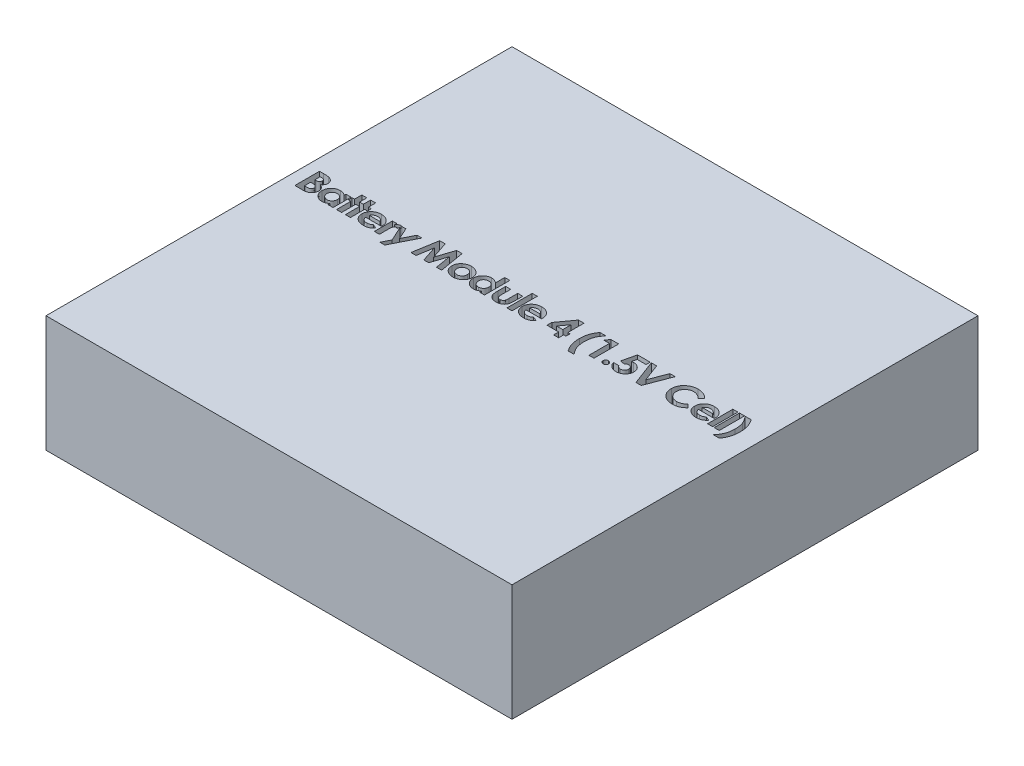
from build123d import *

# Parameters (mm, degrees)
SKETCH1_W           = 60
SKETCH1_H           = 60
BOSS_EXTRUDE1_DEPTH = 15
SKETCH2_W           = 0.651282052
SKETCH2_H           = 3.256410256
SKETCH2_W_2         = 0.651282051
CUT_EXTRUDE1_DEPTH  = 5


with BuildPart() as part:
    # Sketch1 → Boss-Extrude1 (new body)
    with BuildSketch(Plane(origin=(0, 0, 0), x_dir=(1, 0, 0), z_dir=(0, 1, 0))):
        with Locations((30, -30)):
            Rectangle(SKETCH1_W, SKETCH1_H)
    extrude(amount=BOSS_EXTRUDE1_DEPTH)

    # Sketch2 → Cut-Extrude1 (cut)
    # profile 1 of 24: a face of its own
    with BuildSketch(Plane(origin=(0, 15, 0), x_dir=(1, 0, 0), z_dir=(0, 1, 0))):
        with BuildLine():
            Line((1.497396554, -29.456118503), (1.497396554, -26.281118503))
            Line((1.497396554, -26.281118503), (2.041191626, -26.281118503))
            add(Edge.make_bspline(
                [(2.041191626, -26.281118503), (2.079355807, -26.281110113), (2.152943186, -26.281093936), (2.259165048, -26.284620633), (2.357327504, -26.289072003), (2.447745324, -26.294242779), (2.530194075, -26.302807624), (2.604906958, -26.312106832), (2.671660768, -26.323096984), (2.713084928, -26.333049263), (2.732542788, -26.337724072)],
                knots=[0, 0, 0, 0, 1.317464385, 2.540307418, 3.668617805, 4.710020188, 5.666253162, 6.529600743, 7.309320385, 8, 8, 8, 8], degree=3))
            add(Edge.make_bspline(
                [(2.732542788, -26.337724072), (2.757881926, -26.344348854), (2.807817386, -26.357404214), (2.879565132, -26.383040273), (2.947449674, -26.412570457), (3.01178212, -26.445286932), (3.071876893, -26.482877997), (3.127296661, -26.525437482), (3.179642816, -26.570853248), (3.2271666, -26.620732087), (3.270657191, -26.672950205), (3.307342655, -26.728833368), (3.339573378, -26.786185299), (3.365954687, -26.846152772), (3.38521003, -26.908841512), (3.400403439, -26.973339886), (3.408407164, -27.040535796), (3.409820181, -27.086086847), (3.41053758, -27.109213455)],
                knots=[0, 0, 0, 0, 1.129908737, 2.22669428, 3.283953805, 4.323365142, 5.338820687, 6.337986667, 7.3364402, 8.326515777, 9.308269818, 10.264974983, 11.206997704, 12.145325068, 13.085791276, 14.033572947, 15.001630318, 16, 16, 16, 16], degree=3))
            add(Edge.make_bspline(
                [(3.41053758, -27.109213455), (3.409705663, -27.138979452), (3.408063954, -27.197719835), (3.390653022, -27.283378089), (3.363942001, -27.365126526), (3.326083073, -27.443108243), (3.275196337, -27.517310363), (3.211592364, -27.588892753), (3.133918805, -27.657712205), (3.075355209, -27.699355031), (3.044827444, -27.721062414)],
                knots=[0, 0, 0, 0, 0.956911373, 1.888374187, 2.80117783, 3.71980407, 4.668038401, 5.688098977, 6.794862754, 8, 8, 8, 8], degree=3))
            add(Edge.make_bspline(
                [(3.044827444, -27.721062414), (3.070393454, -27.732460551), (3.120387265, -27.754749375), (3.191623644, -27.791861606), (3.258080008, -27.830270382), (3.318544891, -27.87194622), (3.374047898, -27.914959853), (3.424108995, -27.960391126), (3.468629174, -28.008166576), (3.50828339, -28.057866409), (3.542906769, -28.109820379), (3.572854766, -28.164081408), (3.598450435, -28.220573379), (3.618591178, -28.279723809), (3.635412927, -28.34056259), (3.646860121, -28.403989956), (3.653023279, -28.469743877), (3.654180084, -28.51437629), (3.654768349, -28.537073031)],
                knots=[0, 0, 0, 0, 1.23365294, 2.412383099, 3.539175734, 4.614933633, 5.646891323, 6.632618236, 7.591395346, 8.522583599, 9.432375455, 10.340100964, 11.252002374, 12.162322077, 13.091820502, 14.032202097, 14.999323654, 16, 16, 16, 16], degree=3))
            add(Edge.make_bspline(
                [(3.654768349, -28.537073031), (3.654247672, -28.558930038), (3.653213796, -28.602330142), (3.645896157, -28.66670682), (3.634854795, -28.729778889), (3.617717371, -28.791233826), (3.597368493, -28.85153486), (3.570483303, -28.909820863), (3.540301513, -28.966985212), (3.493685772, -29.040450105), (3.426696219, -29.125021672), (3.335072284, -29.214905612), (3.231432193, -29.289674788), (3.136701168, -29.340698548), (3.054564876, -29.375063971), (2.986344387, -29.395796925), (2.913208383, -29.415673453), (2.833893418, -29.42935935), (2.749363963, -29.441971499), (2.659089232, -29.449704788), (2.563213693, -29.455004084), (2.497436439, -29.455739277), (2.463507332, -29.456118503)],
                knots=[0, 0, 0, 0, 0.773521683, 1.535934081, 2.291035939, 3.037398896, 3.792090463, 4.541089556, 5.30652434, 6.078916767, 7.617748108, 9.114279455, 10.607797396, 12.125440584, 12.912816195, 13.755334699, 14.647206127, 15.593606405, 16.601806249, 17.671867784, 18.799106946, 20, 20, 20, 20], degree=3))
            Line((2.463507332, -29.456118503), (1.497396554, -29.456118503))
        make_face()
        with BuildLine():
            Line((2.148678606, -26.850990298), (2.148678606, -27.542977478))
            Line((2.148678606, -27.542977478), (2.291146554, -27.542977478))
            add(Edge.make_bspline(
                [(2.291146554, -27.542977478), (2.310235967, -27.542790972), (2.347410838, -27.542427769), (2.401173804, -27.537982516), (2.451160913, -27.53049587), (2.497030618, -27.519588576), (2.539459379, -27.506294512), (2.578245239, -27.490082023), (2.612836466, -27.470089376), (2.653405452, -27.440622593), (2.696355893, -27.397060765), (2.733494632, -27.334226182), (2.755798304, -27.262479132), (2.758076527, -27.211775273), (2.759255529, -27.185535571)],
                knots=[0, 0, 0, 0, 1.028550141, 2.003006515, 2.904681567, 3.749937983, 4.541273415, 5.29889787, 6.010313909, 6.689050998, 7.997958217, 9.273579902, 10.589053087, 12, 12, 12, 12], degree=3))
            add(Edge.make_bspline(
                [(2.759255529, -27.185535571), (2.757990152, -27.161000366), (2.75555385, -27.113761325), (2.734507619, -27.046760904), (2.69932036, -26.988253697), (2.650355551, -26.938098651), (2.586866416, -26.898161471), (2.509163995, -26.869864398), (2.417298128, -26.85391613), (2.351634017, -26.85200847), (2.31658726, -26.850990298)],
                knots=[0, 0, 0, 0, 0.935650498, 1.801461716, 2.651522647, 3.522093803, 4.454478618, 5.492462911, 6.661657913, 8, 8, 8, 8], degree=3))
            Line((2.31658726, -26.850990298), (2.148678606, -26.850990298))
        make_face(mode=Mode.SUBTRACT)
        with BuildLine():
            Line((2.148678606, -28.072144144), (2.148678606, -28.886246709))
            Line((2.148678606, -28.886246709), (2.312771154, -28.886246709))
            add(Edge.make_bspline(
                [(2.312771154, -28.886246709), (2.345212459, -28.886061373), (2.407584918, -28.885705041), (2.496933354, -28.881399709), (2.578173419, -28.873640106), (2.651089859, -28.863952867), (2.715794357, -28.850828173), (2.772068199, -28.834141806), (2.820683105, -28.815783897), (2.86134758, -28.793109699), (2.894568126, -28.766722556), (2.924546186, -28.739754262), (2.948988428, -28.708643786), (2.968327586, -28.674726616), (2.985065593, -28.638845279), (2.995160777, -28.59959862), (3.002846895, -28.558149818), (3.003269883, -28.529480578), (3.003486298, -28.514812414)],
                knots=[0, 0, 0, 0, 1.753078804, 3.370512758, 4.83203934, 6.162291463, 7.344201807, 8.395507345, 9.331626367, 10.147333109, 10.898971645, 11.62040215, 12.321813352, 13.025280112, 13.727906689, 14.453419512, 15.208716525, 16, 16, 16, 16], degree=3))
            add(Edge.make_bspline(
                [(3.003486298, -28.514812414), (3.003009041, -28.498039138), (3.002079472, -28.465369308), (2.994487675, -28.417618865), (2.9806909, -28.373040659), (2.963313189, -28.330494764), (2.939131181, -28.291504471), (2.91039169, -28.254720475), (2.875667048, -28.221388395), (2.836617163, -28.189492182), (2.791069338, -28.161565319), (2.739002203, -28.137333819), (2.680132903, -28.117096563), (2.614279081, -28.100983646), (2.541729438, -28.087308836), (2.461954439, -28.079143465), (2.375618479, -28.07307052), (2.31575172, -28.072459953), (2.284786378, -28.072144144)],
                knots=[0, 0, 0, 0, 0.845221588, 1.646264278, 2.427170338, 3.19324141, 3.95557735, 4.731569926, 5.540061037, 6.376114724, 7.268642756, 8.224665384, 9.265483498, 10.400594375, 11.639216012, 12.983232105, 14.439614077, 16, 16, 16, 16], degree=3))
            Line((2.284786378, -28.072144144), (2.148678606, -28.072144144))
        make_face(mode=Mode.SUBTRACT)
    # profile 2 of 24: a face of its own
    with BuildSketch(Plane(origin=(0, 15, 0), x_dir=(1, 0, 0), z_dir=(0, 1, 0))):
        with BuildLine():
            Line((5.767364503, -27.135926196), (6.418646554, -27.135926196))
            Line((6.418646554, -27.135926196), (6.418646554, -29.456118503))
            Line((6.418646554, -29.456118503), (5.767364503, -29.456118503))
            Line((5.767364503, -29.456118503), (5.767364503, -29.202983487))
            add(Edge.make_bspline(
                [(5.767364503, -29.202983487), (5.737212737, -29.227645998), (5.678557393, -29.275622889), (5.586449555, -29.337632192), (5.494112503, -29.388775136), (5.400944608, -29.429648974), (5.305662622, -29.459420268), (5.207656794, -29.481417951), (5.105606766, -29.494163197), (5.036190907, -29.495928011), (5.000963261, -29.496823632)],
                knots=[0, 0, 0, 0, 1.112775085, 2.164722404, 3.168089063, 4.125953898, 5.06678566, 6.016394462, 6.993346001, 8, 8, 8, 8], degree=3))
            add(Edge.make_bspline(
                [(5.000963261, -29.496823632), (4.961253873, -29.495995275), (4.882960151, -29.49436203), (4.768008818, -29.47693993), (4.656982419, -29.450334262), (4.549893577, -29.412818286), (4.447184853, -29.364047343), (4.348268937, -29.305249879), (4.254288634, -29.23463363), (4.164507813, -29.155296284), (4.082342041, -29.067838764), (4.010683981, -28.973424861), (3.948964961, -28.874405945), (3.900400861, -28.769121384), (3.860689983, -28.659774485), (3.833818425, -28.544476023), (3.816818447, -28.424157118), (3.814628618, -28.342085639), (3.813518349, -28.300474473)],
                knots=[0, 0, 0, 0, 1.0152099, 2.001656708, 2.967260261, 3.933046601, 4.898711087, 5.871705171, 6.871894424, 7.901591717, 8.933871443, 9.936249634, 10.929769113, 11.912465925, 12.897211317, 13.900997302, 14.935781943, 16, 16, 16, 16], degree=3))
            add(Edge.make_bspline(
                [(3.813518349, -28.300474473), (3.814310988, -28.257371022), (3.815867304, -28.172739053), (3.833574724, -28.049034042), (3.858635298, -27.930673066), (3.89679223, -27.819015372), (3.944568054, -27.712790521), (4.004151008, -27.613276572), (4.072945016, -27.518592664), (4.153296099, -27.432391081), (4.240047522, -27.353576107), (4.332124601, -27.284009425), (4.429505885, -27.225925722), (4.531307091, -27.178066593), (4.637737307, -27.141049595), (4.748432261, -27.114178005), (4.86394587, -27.097914217), (4.942609028, -27.096127538), (4.98251875, -27.095221068)],
                knots=[0, 0, 0, 0, 1.101820251, 2.163381712, 3.191069616, 4.192666871, 5.175648538, 6.165310336, 7.154600546, 8.164081233, 9.173911513, 10.150137213, 11.110950052, 12.069310662, 13.022979241, 13.98849509, 14.979463764, 16, 16, 16, 16], degree=3))
            add(Edge.make_bspline(
                [(4.98251875, -27.095221068), (5.019464706, -27.095925235), (5.092386265, -27.097315076), (5.19978095, -27.112927434), (5.303847777, -27.135917249), (5.404121956, -27.169621353), (5.501473314, -27.211237568), (5.594208323, -27.264152886), (5.684353545, -27.324945247), (5.739433508, -27.372974072), (5.767364503, -27.397329441)],
                knots=[0, 0, 0, 0, 1.029049168, 2.031071275, 3.018790206, 3.996113396, 4.975346277, 5.964866617, 6.967985876, 8, 8, 8, 8], degree=3))
            Line((5.767364503, -27.397329441), (5.767364503, -27.135926196))
        make_face()
        with BuildLine():
            add(Edge.make_bspline(
                [(5.130710857, -27.624387734), (5.107368984, -27.625096179), (5.061388879, -27.626491712), (4.993815791, -27.634601022), (4.929159057, -27.649131128), (4.868070397, -27.670544138), (4.809507485, -27.696350215), (4.754652658, -27.729385148), (4.70229821, -27.76748252), (4.653670248, -27.81131255), (4.609177842, -27.859135778), (4.570818639, -27.911444318), (4.537485663, -27.966264527), (4.511481547, -28.025286295), (4.490144628, -28.086847847), (4.475790879, -28.152391345), (4.46669782, -28.220928618), (4.465438964, -28.26779627), (4.464800401, -28.291570226)],
                knots=[0, 0, 0, 0, 1.06125293, 2.090514301, 3.088852962, 4.067220482, 5.02916782, 5.992803506, 6.972072552, 7.968548639, 8.964372002, 9.935879718, 10.912727001, 11.87467434, 12.862161171, 13.869899327, 14.919490992, 16, 16, 16, 16], degree=3))
            add(Edge.make_bspline(
                [(4.464800401, -28.291570226), (4.465460102, -28.315550893), (4.466760754, -28.362830577), (4.475560516, -28.432119705), (4.491014351, -28.498080112), (4.512029228, -28.560727138), (4.538813637, -28.62032109), (4.571880283, -28.676589784), (4.612055743, -28.728871126), (4.656557059, -28.778241106), (4.706188057, -28.822555762), (4.758881154, -28.861535818), (4.814665466, -28.8940812), (4.872967573, -28.921053875), (4.934081943, -28.942173241), (4.998100722, -28.956561817), (5.064720781, -28.965805935), (5.110114972, -28.967031981), (5.133254928, -28.967656965)],
                knots=[0, 0, 0, 0, 1.082549706, 2.134328006, 3.146519463, 4.136198695, 5.112834422, 6.091110098, 7.074987703, 8.084460647, 9.087516082, 10.073346842, 11.03851981, 11.997742943, 12.969300807, 13.95136129, 14.955694387, 16, 16, 16, 16], degree=3))
            add(Edge.make_bspline(
                [(5.133254928, -28.967656965), (5.157020016, -28.96695309), (5.203633451, -28.965572492), (5.272063505, -28.957470281), (5.337497351, -28.942769186), (5.39958873, -28.921731115), (5.458777588, -28.895345859), (5.515064101, -28.863839767), (5.567356421, -28.824888753), (5.616894924, -28.781424672), (5.661692264, -28.732840705), (5.700916911, -28.680182965), (5.734134489, -28.623876389), (5.761543767, -28.564029661), (5.782751126, -28.500502263), (5.797078981, -28.433282577), (5.806198326, -28.362629301), (5.807438198, -28.314283428), (5.808069631, -28.289662173)],
                knots=[0, 0, 0, 0, 1.062730516, 2.084465995, 3.075623017, 4.055840787, 5.010610896, 5.970028257, 6.933184594, 7.920344632, 8.913177399, 9.881961517, 10.850884751, 11.830735776, 12.819941745, 13.838859124, 14.899389017, 16, 16, 16, 16], degree=3))
            add(Edge.make_bspline(
                [(5.808069631, -28.289662173), (5.807447838, -28.265463899), (5.806232619, -28.218171336), (5.797044274, -28.148998249), (5.782610445, -28.083095033), (5.761832835, -28.020663344), (5.733957963, -27.962268346), (5.700711232, -27.907318141), (5.661906969, -27.855366161), (5.616614189, -27.808112408), (5.567359155, -27.764915488), (5.514390823, -27.727395362), (5.458547087, -27.695112538), (5.399320599, -27.668890169), (5.336424786, -27.649532148), (5.270814337, -27.634483378), (5.201715953, -27.626497315), (5.154685213, -27.625100019), (5.130710857, -27.624387734)],
                knots=[0, 0, 0, 0, 1.089815487, 2.129910827, 3.137850205, 4.125449086, 5.086697262, 6.046521014, 7.014954071, 8.001305313, 8.989596646, 9.962165112, 10.920514735, 11.891205654, 12.872875738, 13.880815117, 14.919725862, 16, 16, 16, 16], degree=3))
        make_face(mode=Mode.SUBTRACT)
    # profile 3 of 24: a face of its own
    with BuildSketch(Plane(origin=(0, 15, 0), x_dir=(1, 0, 0), z_dir=(0, 1, 0))):
        Polygon((6.862332452, -26.199708247), (7.513614503, -26.199708247), (7.513614503, -27.135926196), (7.879960657, -27.135926196), (7.879960657, -27.624387734), (7.513614503, -27.624387734), (7.513614503, -29.456118503), (6.862332452, -29.456118503), (6.862332452, -27.624387734), (6.536691426, -27.624387734), (6.536691426, -27.135926196), (6.862332452, -27.135926196), align=None)
    # profile 4 of 24: a face of its own
    with BuildSketch(Plane(origin=(0, 15, 0), x_dir=(1, 0, 0), z_dir=(0, 1, 0))):
        Polygon((7.998005529, -26.199708247), (8.64928758, -26.199708247), (8.64928758, -27.135926196), (9.015633734, -27.135926196), (9.015633734, -27.624387734), (8.64928758, -27.624387734), (8.64928758, -29.456118503), (7.998005529, -29.456118503), (7.998005529, -27.624387734), (7.672364503, -27.624387734), (7.672364503, -27.135926196), (7.998005529, -27.135926196), align=None)
    # profile 5 of 24: a face of its own
    with BuildSketch(Plane(origin=(0, 15, 0), x_dir=(1, 0, 0), z_dir=(0, 1, 0))):
        with BuildLine():
            Line((11.614147356, -28.438490298), (9.581435016, -28.438490298))
            add(Edge.make_bspline(
                [(9.581435016, -28.438490298), (9.585548912, -28.459766953), (9.593650251, -28.501666268), (9.611484671, -28.562438149), (9.634553454, -28.619475091), (9.661240268, -28.673609463), (9.693211606, -28.724146261), (9.730392002, -28.770940874), (9.770995178, -28.815473883), (9.817075539, -28.855181663), (9.866387735, -28.89152956), (9.919592715, -28.923002046), (9.976472474, -28.948895946), (10.036286113, -28.970421985), (10.099126496, -28.987942941), (10.165555006, -28.999856793), (10.235325096, -29.006776901), (10.282946917, -29.007828202), (10.30713113, -29.008362093)],
                knots=[0, 0, 0, 0, 1.02675315, 2.021946266, 2.995963183, 3.939653043, 4.879107122, 5.823866319, 6.769533503, 7.73087287, 8.701618913, 9.670126111, 10.654762421, 11.659195967, 12.680625029, 13.742950566, 14.85378253, 16, 16, 16, 16], degree=3))
            add(Edge.make_bspline(
                [(10.30713113, -29.008362093), (10.336432762, -29.007685063), (10.393994731, -29.006355062), (10.478627642, -28.99416143), (10.560443847, -28.976314559), (10.638661242, -28.949206074), (10.713895746, -28.915264248), (10.785872666, -28.873720471), (10.855101649, -28.824740906), (10.897503931, -28.786619411), (10.918980088, -28.767311412)],
                knots=[0, 0, 0, 0, 1.042357442, 2.04767252, 3.038064469, 4.018865418, 4.988131768, 5.971860357, 6.97277591, 8, 8, 8, 8], degree=3))
            Line((10.918980088, -28.767311412), (11.453870913, -28.994369705))
            add(Edge.make_bspline(
                [(11.453870913, -28.994369705), (11.437189958, -29.015175613), (11.403988678, -29.056587079), (11.349609627, -29.113973669), (11.293846994, -29.168420776), (11.235181771, -29.218139241), (11.173810259, -29.263323237), (11.110304101, -29.304894722), (11.04380331, -29.341680191), (10.975158697, -29.374976118), (10.903457684, -29.403629432), (10.828614527, -29.428351001), (10.75082813, -29.4501099), (10.669419342, -29.467182151), (10.585129878, -29.480419619), (10.497477407, -29.489949969), (10.406641505, -29.495765102), (10.344876894, -29.496466976), (10.313491306, -29.496823632)],
                knots=[0, 0, 0, 0, 0.988037034, 1.966559754, 2.927989197, 3.875802216, 4.814087919, 5.751320033, 6.687068532, 7.628999734, 8.57749659, 9.546634608, 10.549435947, 11.56972693, 12.627810391, 13.710812346, 14.836752995, 16, 16, 16, 16], degree=3))
            add(Edge.make_bspline(
                [(10.313491306, -29.496823632), (10.265110985, -29.495922751), (10.170197737, -29.494155389), (10.031429999, -29.478064054), (9.89957293, -29.451213324), (9.774419137, -29.41457616), (9.656080029, -29.366781398), (9.544964489, -29.307672851), (9.440003875, -29.239212242), (9.344037271, -29.159440968), (9.256297737, -29.073163712), (9.18007004, -28.979654256), (9.115796276, -28.880773767), (9.062153767, -28.777067546), (9.021422478, -28.667414646), (8.992364276, -28.552482638), (8.973830812, -28.43230607), (8.971859432, -28.350364147), (8.970858093, -28.308742702)],
                knots=[0, 0, 0, 0, 1.156492121, 2.268823763, 3.334565049, 4.370720398, 5.382660527, 6.380407603, 7.375834034, 8.373439447, 9.359176821, 10.313980535, 11.25179889, 12.17452123, 13.100079815, 14.041862899, 15.005387074, 16, 16, 16, 16], degree=3))
            add(Edge.make_bspline(
                [(8.970858093, -28.308742702), (8.971847695, -28.266059117), (8.9737965, -28.182003181), (8.992439845, -28.05917712), (9.020614001, -27.941511289), (9.061915257, -27.829759931), (9.113759224, -27.722890027), (9.179099252, -27.62276698), (9.254257209, -27.527200449), (9.341177902, -27.438897858), (9.436789682, -27.358713461), (9.538683126, -27.287322762), (9.647341913, -27.228319151), (9.761505811, -27.179671074), (9.88146255, -27.141030666), (10.007762186, -27.11517621), (10.139576111, -27.097589421), (10.229476833, -27.096021022), (10.275330248, -27.095221068)],
                knots=[0, 0, 0, 0, 1.027660379, 2.023751168, 2.986290373, 3.938022534, 4.888273355, 5.841771876, 6.812555766, 7.813036829, 8.820805457, 9.815428515, 10.805160989, 11.793719818, 12.801669636, 13.835480315, 14.895997518, 16, 16, 16, 16], degree=3))
            add(Edge.make_bspline(
                [(10.275330248, -27.095221068), (10.323923904, -27.096101834), (10.418841145, -27.09782222), (10.557804845, -27.114089929), (10.689648179, -27.140831784), (10.815085348, -27.177082942), (10.932494136, -27.226444577), (11.044204287, -27.283859768), (11.147973268, -27.353888974), (11.244594511, -27.433170821), (11.332063863, -27.520945462), (11.40841004, -27.616488556), (11.473218523, -27.718698211), (11.525332292, -27.828206796), (11.56638665, -27.944152878), (11.595348697, -28.066971686), (11.613778462, -28.196669066), (11.615706229, -28.285569986), (11.616691426, -28.331003319)],
                knots=[0, 0, 0, 0, 1.136656473, 2.220213596, 3.267968283, 4.28191029, 5.269443916, 6.243492268, 7.216188134, 8.192406648, 9.164026768, 10.109943221, 11.048534419, 11.989272945, 12.941606068, 13.920982876, 14.937506202, 16, 16, 16, 16], degree=3))
            Line((11.616691426, -28.331003319), (11.614147356, -28.438490298))
        make_face()
        with BuildLine():
            add(Edge.make_bspline(
                [(10.965409375, -27.990733888), (10.953700675, -27.961611252), (10.93023162, -27.903237497), (10.876259631, -27.824048263), (10.806376458, -27.754573036), (10.723552527, -27.69418802), (10.629750372, -27.644766784), (10.527600809, -27.60888343), (10.418056017, -27.587442756), (10.342633728, -27.584957333), (10.303951042, -27.583682606)],
                knots=[0, 0, 0, 0, 0.907776179, 1.819557287, 2.753735674, 3.75169848, 4.779685399, 5.815520848, 6.87962135, 8, 8, 8, 8], degree=3))
            add(Edge.make_bspline(
                [(10.303951042, -27.583682606), (10.262040481, -27.58492842), (10.180024925, -27.587366377), (10.06145014, -27.612976399), (9.949430112, -27.651139827), (9.882537734, -27.691013174), (9.849198437, -27.710886132)],
                knots=[0, 0, 0, 0, 1.04897034, 2.052749604, 3.029486454, 4, 4, 4, 4], degree=3))
            add(Edge.make_bspline(
                [(9.849198437, -27.710886132), (9.828486668, -27.725920915), (9.784773051, -27.757652862), (9.727420837, -27.821978198), (9.671791477, -27.900168753), (9.639322945, -27.959392076), (9.622140144, -27.990733888)],
                knots=[0, 0, 0, 0, 0.841454166, 1.775946969, 2.822999996, 4, 4, 4, 4], degree=3))
            Line((9.622140144, -27.990733888), (10.965409375, -27.990733888))
        make_face(mode=Mode.SUBTRACT)
    # profile 6 of 24: a face of its own
    with BuildSketch(Plane(origin=(0, 15, 0), x_dir=(1, 0, 0), z_dir=(0, 1, 0))):
        with BuildLine():
            Line((11.734736298, -27.135926196), (12.304608093, -27.135926196))
            Line((12.304608093, -27.135926196), (12.304608093, -27.421498111))
            add(Edge.make_bspline(
                [(12.304608093, -27.421498111), (12.318425732, -27.396119256), (12.345432881, -27.346515232), (12.395047279, -27.279931652), (12.452046309, -27.22385682), (12.514381819, -27.177117877), (12.582242737, -27.140689461), (12.653811867, -27.114729622), (12.728476937, -27.097859323), (12.779410917, -27.096106818), (12.805153966, -27.095221068)],
                knots=[0, 0, 0, 0, 1.09866127, 2.147379032, 3.14564304, 4.131443017, 5.102343063, 6.064490016, 7.021754664, 8, 8, 8, 8], degree=3))
            add(Edge.make_bspline(
                [(12.805153966, -27.095221068), (12.823846632, -27.096096375), (12.861911574, -27.097878812), (12.919927903, -27.108240149), (12.978781305, -27.126975416), (13.017511915, -27.143844034), (13.037300401, -27.152462654)],
                knots=[0, 0, 0, 0, 0.931404136, 1.896671404, 2.925354185, 4, 4, 4, 4], degree=3))
            Line((13.037300401, -27.152462654), (12.8604875, -27.635200034))
            add(Edge.make_bspline(
                [(12.8604875, -27.635200034), (12.844682951, -27.62756404), (12.814976484, -27.613211312), (12.771847852, -27.596273613), (12.73270683, -27.585939058), (12.707892141, -27.584397051), (12.696394952, -27.583682606)],
                knots=[0, 0, 0, 0, 1.214386998, 2.282580073, 3.20428172, 4, 4, 4, 4], degree=3))
            add(Edge.make_bspline(
                [(12.696394952, -27.583682606), (12.685539369, -27.584156035), (12.664184568, -27.585087352), (12.632665479, -27.593068421), (12.602981061, -27.606831526), (12.573700822, -27.62446343), (12.54713465, -27.648973096), (12.520584888, -27.677347386), (12.497187815, -27.71237922), (12.472497118, -27.751371431), (12.451473873, -27.799097863), (12.433447087, -27.856073386), (12.417385076, -27.922957248), (12.40633222, -28.00010457), (12.395649191, -28.086768816), (12.389290389, -28.183586093), (12.384551094, -28.290250254), (12.384261318, -28.364705689), (12.384110296, -28.403509329)],
                knots=[0, 0, 0, 0, 0.544232178, 1.070598461, 1.618251235, 2.182094276, 2.777567932, 3.425210017, 4.127676488, 4.886675562, 5.738955394, 6.734782583, 7.883056018, 9.186093582, 10.642914445, 12.264202625, 14.053029461, 16, 16, 16, 16], degree=3))
            Line((12.384110296, -28.403509329), (12.386018349, -28.516720467))
            Line((12.386018349, -28.516720467), (12.386018349, -29.456118503))
            Line((12.386018349, -29.456118503), (11.734736298, -29.456118503))
            Line((11.734736298, -29.456118503), (11.734736298, -27.135926196))
        make_face()
    # profile 7 of 24: a face of its own
    with BuildSketch(Plane(origin=(0, 15, 0), x_dir=(1, 0, 0), z_dir=(0, 1, 0))):
        Polygon((12.850692828, -27.135926196), (13.468901963, -27.135926196), (14.151348878, -28.626115499), (14.908209856, -27.135926196), (15.536595272, -27.135926196), (13.924926602, -30.310926196), (13.295905168, -30.310926196), (13.82634387, -29.26658525), align=None)
    # profile 8 of 24: a face of its own
    with BuildSketch(Plane(origin=(0, 15, 0), x_dir=(1, 0, 0), z_dir=(0, 1, 0))):
        Polygon((16.977302404, -26.281118503), (17.680101883, -26.281118503), (18.418518349, -28.495731885), (19.160114904, -26.281118503), (19.859734295, -26.281118503), (20.392717067, -29.456118503), (19.731894751, -29.456118503), (19.395441426, -27.450754922), (18.723806811, -29.456118503), (18.1100498, -29.456118503), (17.441595272, -27.450754922), (17.105141947, -29.456118503), (16.444319631, -29.456118503), align=None)
    # profile 9 of 24: a face of its own
    with BuildSketch(Plane(origin=(0, 15, 0), x_dir=(1, 0, 0), z_dir=(0, 1, 0))):
        with BuildLine():
            add(Edge.make_bspline(
                [(21.859119311, -27.095221068), (21.888603013, -27.095717097), (21.947456605, -27.09670724), (22.034980587, -27.104460558), (22.12110794, -27.11743962), (22.206027511, -27.13423468), (22.289414766, -27.157405716), (22.371297615, -27.18543993), (22.452189473, -27.21791976), (22.530755153, -27.255980463), (22.607035421, -27.297570916), (22.679173889, -27.343625042), (22.747062851, -27.393202967), (22.811335095, -27.445957635), (22.869903413, -27.503434599), (22.925511823, -27.563291425), (22.97530139, -27.627893797), (23.021861028, -27.694905005), (23.063028992, -27.764664735), (23.098844431, -27.836327597), (23.12928498, -27.909193658), (23.154480227, -27.983502689), (23.173289277, -28.059314348), (23.187462937, -28.136377527), (23.195979639, -28.214842727), (23.196858523, -28.267592969), (23.197300401, -28.294114297)],
                knots=[0, 0, 0, 0, 1.063534305, 2.122963189, 3.166733874, 4.204688069, 5.243740614, 6.286165438, 7.325780789, 8.386230624, 9.433665587, 10.458433384, 11.47114332, 12.465080467, 13.454889461, 14.429302241, 15.409997953, 16.394355045, 17.371555249, 18.329256343, 19.282334902, 20.218320937, 21.156928088, 22.097527377, 23.043490666, 24, 24, 24, 24], degree=3))
            add(Edge.make_bspline(
                [(23.197300401, -28.294114297), (23.196863983, -28.320848908), (23.195995938, -28.374024645), (23.187398288, -28.453102637), (23.173522319, -28.530932842), (23.153504021, -28.607322952), (23.128974283, -28.682529482), (23.098014916, -28.756162813), (23.061653156, -28.82846334), (23.020819834, -28.899593171), (22.973995492, -28.967295514), (22.924287863, -29.032591292), (22.868833406, -29.092606794), (22.811360666, -29.150757985), (22.748006177, -29.202916593), (22.681490533, -29.252384716), (22.611125546, -29.298136565), (22.536658145, -29.339392518), (22.459200528, -29.37601663), (22.37971071, -29.408672417), (22.298113216, -29.436025674), (22.214631393, -29.458307941), (22.129240825, -29.475556484), (22.041697333, -29.487380015), (21.952338933, -29.495413834), (21.891997855, -29.496352), (21.861663381, -29.496823632)],
                knots=[0, 0, 0, 0, 0.962255952, 1.91394855, 2.860207508, 3.806250935, 4.754877505, 5.706080202, 6.678964481, 7.667414947, 8.65613063, 9.640919719, 10.619059965, 11.596008156, 12.582127542, 13.569870413, 14.579779746, 15.601419098, 16.632538513, 17.663036175, 18.693731709, 19.728742686, 20.772135591, 21.827880056, 22.908038811, 24, 24, 24, 24], degree=3))
            add(Edge.make_bspline(
                [(21.861663381, -29.496823632), (21.817310836, -29.495634564), (21.729804178, -29.493288559), (21.60091744, -29.477374488), (21.477027616, -29.449923851), (21.358197926, -29.411623183), (21.244206952, -29.362645257), (21.135917626, -29.301430183), (21.031518456, -29.230861478), (20.93407308, -29.149340799), (20.844779031, -29.060254773), (20.766045923, -28.965623319), (20.700245381, -28.865528374), (20.645501455, -28.761365565), (20.603357432, -28.652050061), (20.573746412, -28.538090282), (20.5542501, -28.419654918), (20.552404367, -28.338926108), (20.551467067, -28.297930402)],
                knots=[0, 0, 0, 0, 1.077736675, 2.126352257, 3.150069816, 4.15693894, 5.156094406, 6.159385312, 7.175360386, 8.21427489, 9.241577028, 10.236966576, 11.200033802, 12.14710773, 13.091417169, 14.039877316, 15.004610452, 16, 16, 16, 16], degree=3))
            add(Edge.make_bspline(
                [(20.551467067, -28.297930402), (20.552802823, -28.254173295), (20.555430879, -28.168082646), (20.576461621, -28.042003946), (20.609995421, -27.92123824), (20.65835436, -27.806516785), (20.718806841, -27.696403838), (20.794920744, -27.593600743), (20.882972364, -27.49492685), (20.950616535, -27.436256303), (20.98523109, -27.406233688)],
                knots=[0, 0, 0, 0, 1.022387645, 2.011513601, 2.979556127, 3.94597344, 4.915448461, 5.908725038, 6.929862674, 8, 8, 8, 8], degree=3))
            add(Edge.make_bspline(
                [(20.98523109, -27.406233688), (21.01701262, -27.381235099), (21.079884042, -27.331781949), (21.18122857, -27.268961472), (21.285672844, -27.215360661), (21.393443354, -27.171130159), (21.504870919, -27.137344324), (21.619785523, -27.113256373), (21.738302742, -27.0982161), (21.818581999, -27.096225984), (21.859119311, -27.095221068)],
                knots=[0, 0, 0, 0, 1.024531182, 2.026766207, 3.017212978, 3.998427549, 4.97614649, 5.965016719, 6.972427573, 8, 8, 8, 8], degree=3))
        make_face()
        with BuildLine():
            add(Edge.make_bspline(
                [(21.873111699, -27.624387734), (21.849564577, -27.625115628), (21.803385486, -27.626543125), (21.735452838, -27.634308632), (21.671184751, -27.650214771), (21.609325366, -27.670211861), (21.551079242, -27.697381878), (21.49478914, -27.728907939), (21.443000653, -27.76846639), (21.393486535, -27.811852972), (21.34829286, -27.859868662), (21.30955874, -27.912135975), (21.276765387, -27.967662533), (21.249242373, -28.026063878), (21.228178233, -28.088159625), (21.213715729, -28.153652206), (21.204652815, -28.222203592), (21.203389795, -28.269069294), (21.202749118, -28.292842261)],
                knots=[0, 0, 0, 0, 1.066781127, 2.09210208, 3.088794439, 4.06033775, 5.03131163, 5.994708781, 6.975928822, 7.975760668, 8.97430098, 9.955521021, 10.91546753, 11.890467711, 12.874174054, 13.878054192, 14.923627606, 16, 16, 16, 16], degree=3))
            add(Edge.make_bspline(
                [(21.202749118, -28.292842261), (21.203378945, -28.317462197), (21.20461028, -28.365595119), (21.213667008, -28.435854308), (21.22835025, -28.502471572), (21.248424235, -28.565774886), (21.275583879, -28.625258335), (21.307988828, -28.681406711), (21.346341019, -28.734098105), (21.39101729, -28.781958975), (21.439415311, -28.825887366), (21.492275665, -28.863408688), (21.547471704, -28.896316507), (21.60637393, -28.922168059), (21.668060044, -28.942845719), (21.732826388, -28.957412847), (21.801032037, -28.965609615), (21.847437371, -28.966963552), (21.871203646, -28.967656965)],
                knots=[0, 0, 0, 0, 1.107846323, 2.165882198, 3.182179368, 4.174912277, 5.148570196, 6.119043769, 7.088531828, 8.07440886, 9.060932096, 10.024816539, 10.987046649, 11.94809335, 12.913629291, 13.91130211, 14.930283168, 16, 16, 16, 16], degree=3))
            add(Edge.make_bspline(
                [(21.871203646, -28.967656965), (21.894977738, -28.96703435), (21.941425128, -28.965817949), (22.009547513, -28.956621054), (22.074672743, -28.941969629), (22.137148149, -28.92197509), (22.196026411, -28.894854587), (22.251713291, -28.8620828), (22.304869957, -28.823930063), (22.35400094, -28.779471717), (22.39898308, -28.730772805), (22.438905534, -28.678466724), (22.472013902, -28.622237439), (22.498787109, -28.562632938), (22.519805168, -28.499988785), (22.535257615, -28.434027587), (22.544086505, -28.364528113), (22.545366375, -28.317035371), (22.546018349, -28.292842261)],
                knots=[0, 0, 0, 0, 1.067186011, 2.084958876, 3.080271322, 4.061602356, 5.024289384, 5.984242974, 6.959135639, 7.956766839, 8.953762054, 9.932319133, 10.905304575, 11.876658937, 12.860986267, 13.867704084, 14.913794669, 16, 16, 16, 16], degree=3))
            add(Edge.make_bspline(
                [(22.546018349, -28.292842261), (22.545383079, -28.268645737), (22.544136001, -28.221146293), (22.535077205, -28.151741906), (22.520550012, -28.08591394), (22.500152374, -28.023573354), (22.47330775, -27.964670763), (22.440054248, -27.909506582), (22.401594353, -27.857273214), (22.357378826, -27.80935227), (22.308251046, -27.766328123), (22.256293429, -27.727757635), (22.200416021, -27.69593508), (22.141464206, -27.669537664), (22.07894311, -27.649362484), (22.01320011, -27.634534617), (21.944120787, -27.62648374), (21.897087402, -27.625095435), (21.873111699, -27.624387734)],
                knots=[0, 0, 0, 0, 1.09050965, 2.140745592, 3.149326982, 4.125466617, 5.091968497, 6.060594197, 7.023925271, 8.01136734, 8.993104687, 9.964131767, 10.923091815, 11.885664136, 12.870883903, 13.879465293, 14.919037777, 16, 16, 16, 16], degree=3))
        make_face(mode=Mode.SUBTRACT)
    # profile 10 of 24: a face of its own
    with BuildSketch(Plane(origin=(0, 15, 0), x_dir=(1, 0, 0), z_dir=(0, 1, 0))):
        with BuildLine():
            Line((25.269191426, -26.199708247), (25.920473477, -26.199708247))
            Line((25.920473477, -26.199708247), (25.920473477, -29.456118503))
            Line((25.920473477, -29.456118503), (25.269191426, -29.456118503))
            Line((25.269191426, -29.456118503), (25.269191426, -29.202983487))
            add(Edge.make_bspline(
                [(25.269191426, -29.202983487), (25.23903966, -29.227645998), (25.180384316, -29.275622889), (25.088276478, -29.337632192), (24.995939426, -29.388775136), (24.902771531, -29.429648974), (24.807489545, -29.459420268), (24.709483717, -29.481417951), (24.607433689, -29.494163197), (24.53801783, -29.495928011), (24.502790184, -29.496823632)],
                knots=[0, 0, 0, 0, 1.112775085, 2.164722404, 3.168089063, 4.125953898, 5.06678566, 6.016394462, 6.993346001, 8, 8, 8, 8], degree=3))
            add(Edge.make_bspline(
                [(24.502790184, -29.496823632), (24.463080797, -29.495995275), (24.384787074, -29.49436203), (24.269835741, -29.47693993), (24.158809342, -29.450334262), (24.0517205, -29.412818286), (23.949011776, -29.364047343), (23.85009586, -29.305249879), (23.756115557, -29.23463363), (23.666334736, -29.155296284), (23.584168964, -29.067838764), (23.512510904, -28.973424861), (23.450791884, -28.874405945), (23.402227784, -28.769121384), (23.362516906, -28.659774485), (23.335645348, -28.544476023), (23.31864537, -28.424157118), (23.316455541, -28.342085639), (23.315345272, -28.300474473)],
                knots=[0, 0, 0, 0, 1.0152099, 2.001656708, 2.967260261, 3.933046601, 4.898711087, 5.871705171, 6.871894424, 7.901591717, 8.933871443, 9.936249634, 10.929769113, 11.912465925, 12.897211317, 13.900997302, 14.935781943, 16, 16, 16, 16], degree=3))
            add(Edge.make_bspline(
                [(23.315345272, -28.300474473), (23.316137911, -28.257371022), (23.317694227, -28.172739053), (23.335401647, -28.049034042), (23.360462222, -27.930673066), (23.398619153, -27.819015372), (23.446394977, -27.712790521), (23.505977931, -27.613276572), (23.574771939, -27.518592664), (23.655123022, -27.432391081), (23.741874445, -27.353576107), (23.833951524, -27.284009425), (23.931332808, -27.225925722), (24.033134014, -27.178066593), (24.13956423, -27.141049595), (24.250259184, -27.114178005), (24.365772793, -27.097914217), (24.444435951, -27.096127538), (24.484345673, -27.095221068)],
                knots=[0, 0, 0, 0, 1.101820251, 2.163381712, 3.191069616, 4.192666871, 5.175648538, 6.165310336, 7.154600546, 8.164081233, 9.173911513, 10.150137213, 11.110950052, 12.069310662, 13.022979241, 13.98849509, 14.979463764, 16, 16, 16, 16], degree=3))
            add(Edge.make_bspline(
                [(24.484345673, -27.095221068), (24.521270562, -27.096304789), (24.594113511, -27.098442682), (24.701862827, -27.11225916), (24.805549081, -27.137608884), (24.906311125, -27.171152671), (25.00314295, -27.215342618), (25.096289051, -27.269136727), (25.186196566, -27.332064406), (25.241256788, -27.381269587), (25.269191426, -27.406233688)],
                knots=[0, 0, 0, 0, 1.024354497, 2.020777991, 3.006418081, 3.98090708, 4.962591761, 5.953166995, 6.961545411, 8, 8, 8, 8], degree=3))
            Line((25.269191426, -27.406233688), (25.269191426, -26.199708247))
        make_face()
        with BuildLine():
            add(Edge.make_bspline(
                [(24.63253778, -27.624387734), (24.609195907, -27.625096179), (24.563215802, -27.626491712), (24.495642714, -27.634601022), (24.430985981, -27.649131128), (24.36989732, -27.670544138), (24.311334408, -27.696350215), (24.256479581, -27.729385148), (24.204125133, -27.76748252), (24.155497171, -27.81131255), (24.111004765, -27.859135778), (24.072645562, -27.911444318), (24.039312586, -27.966264527), (24.01330847, -28.025286295), (23.991971551, -28.086847847), (23.977617802, -28.152391345), (23.968524744, -28.220928618), (23.967265887, -28.26779627), (23.966627324, -28.291570226)],
                knots=[0, 0, 0, 0, 1.06125293, 2.090514301, 3.088852962, 4.067220482, 5.02916782, 5.992803506, 6.972072552, 7.968548639, 8.964372002, 9.935879718, 10.912727001, 11.87467434, 12.862161171, 13.869899327, 14.919490992, 16, 16, 16, 16], degree=3))
            add(Edge.make_bspline(
                [(23.966627324, -28.291570226), (23.967287025, -28.315550893), (23.968587677, -28.362830577), (23.977387439, -28.432119705), (23.992841275, -28.498080112), (24.013856151, -28.560727138), (24.04064056, -28.62032109), (24.073707206, -28.676589784), (24.113882666, -28.728871126), (24.158383982, -28.778241106), (24.20801498, -28.822555762), (24.260708077, -28.861535818), (24.316492389, -28.8940812), (24.374794497, -28.921053875), (24.435908866, -28.942173241), (24.499927645, -28.956561817), (24.566547704, -28.965805935), (24.611941895, -28.967031981), (24.635081851, -28.967656965)],
                knots=[0, 0, 0, 0, 1.082549706, 2.134328006, 3.146519463, 4.136198695, 5.112834422, 6.091110098, 7.074987703, 8.084460647, 9.087516082, 10.073346842, 11.03851981, 11.997742943, 12.969300807, 13.95136129, 14.955694387, 16, 16, 16, 16], degree=3))
            add(Edge.make_bspline(
                [(24.635081851, -28.967656965), (24.658846939, -28.96695309), (24.705460374, -28.965572492), (24.773890428, -28.957470281), (24.839324274, -28.942769186), (24.901415653, -28.921731115), (24.960604511, -28.895345859), (25.016891024, -28.863839767), (25.069183344, -28.824888753), (25.118721848, -28.781424672), (25.163519187, -28.732840705), (25.202743834, -28.680182965), (25.235961412, -28.623876389), (25.26337069, -28.564029661), (25.284578049, -28.500502263), (25.298905904, -28.433282577), (25.308025249, -28.362629301), (25.309265121, -28.314283428), (25.309896554, -28.289662173)],
                knots=[0, 0, 0, 0, 1.062730516, 2.084465995, 3.075623017, 4.055840787, 5.010610896, 5.970028257, 6.933184594, 7.920344632, 8.913177399, 9.881961517, 10.850884751, 11.830735776, 12.819941745, 13.838859124, 14.899389017, 16, 16, 16, 16], degree=3))
            add(Edge.make_bspline(
                [(25.309896554, -28.289662173), (25.309274761, -28.265463899), (25.308059542, -28.218171336), (25.298871197, -28.148998249), (25.284437368, -28.083095033), (25.263659758, -28.020663344), (25.235784887, -27.962268346), (25.202538155, -27.907318141), (25.163733892, -27.855366161), (25.118441112, -27.808112408), (25.069186078, -27.764915488), (25.016217746, -27.727395362), (24.96037401, -27.695112538), (24.901147522, -27.668890169), (24.838251709, -27.649532148), (24.77264126, -27.634483378), (24.703542877, -27.626497315), (24.656512136, -27.625100019), (24.63253778, -27.624387734)],
                knots=[0, 0, 0, 0, 1.089815487, 2.129910827, 3.137850205, 4.125449086, 5.086697262, 6.046521014, 7.014954071, 8.001305313, 8.989596646, 9.962165112, 10.920514735, 11.891205654, 12.872875738, 13.880815117, 14.919725862, 16, 16, 16, 16], degree=3))
        make_face(mode=Mode.SUBTRACT)
    # profile 11 of 24: a face of its own
    with BuildSketch(Plane(origin=(0, 15, 0), x_dir=(1, 0, 0), z_dir=(0, 1, 0))):
        with BuildLine():
            Line((26.323454247, -27.135926196), (26.974736298, -27.135926196))
            Line((26.974736298, -27.135926196), (26.974736298, -28.249593063))
            add(Edge.make_bspline(
                [(26.974736298, -28.249593063), (26.974762477, -28.275673655), (26.974812722, -28.325728681), (26.977835379, -28.397587107), (26.980562405, -28.46336424), (26.98543474, -28.523023874), (26.992804128, -28.576374964), (26.999814161, -28.62367492), (27.009512891, -28.664619369), (27.02342734, -28.710560669), (27.045926067, -28.760742155), (27.080168144, -28.813823925), (27.121188647, -28.860150307), (27.169169497, -28.899233054), (27.223916714, -28.930269048), (27.285156228, -28.951508424), (27.351912646, -28.965387843), (27.39846245, -28.966884402), (27.422492708, -28.967656965)],
                knots=[0, 0, 0, 0, 1.288038235, 2.472059923, 3.551895468, 4.539775699, 5.426892418, 6.211906503, 6.900243993, 7.503061065, 8.581168954, 9.603576598, 10.612325974, 11.624656143, 12.646849265, 13.703434433, 14.814451229, 16, 16, 16, 16], degree=3))
            add(Edge.make_bspline(
                [(27.422492708, -28.967656965), (27.446720601, -28.966821889), (27.493413815, -28.965212488), (27.560745322, -28.952281404), (27.62213633, -28.930748893), (27.677939733, -28.900459553), (27.727334313, -28.861206432), (27.770119745, -28.813643145), (27.806593472, -28.758211594), (27.823847305, -28.716764944), (27.832724078, -28.69544142)],
                knots=[0, 0, 0, 0, 1.101660189, 2.123174873, 3.105503653, 4.050813753, 4.998335683, 5.961198167, 6.951074723, 8, 8, 8, 8], degree=3))
            add(Edge.make_bspline(
                [(27.832724078, -28.69544142), (27.835873216, -28.685950747), (27.842849318, -28.664926614), (27.849957006, -28.629056545), (27.856308473, -28.586398413), (27.861019526, -28.536482294), (27.865827123, -28.479696117), (27.867770246, -28.415599433), (27.870006428, -28.344586992), (27.870165744, -28.294752913), (27.870249118, -28.268673592)],
                knots=[0, 0, 0, 0, 0.557766185, 1.235586879, 2.037333118, 2.965326398, 4.033717005, 5.218189717, 6.544214578, 8, 8, 8, 8], degree=3))
            Line((27.870249118, -28.268673592), (27.870249118, -27.135926196))
            Line((27.870249118, -27.135926196), (28.52153117, -27.135926196))
            Line((28.52153117, -27.135926196), (28.52153117, -28.11094122))
            add(Edge.make_bspline(
                [(28.52153117, -28.11094122), (28.521066951, -28.159280519), (28.520176996, -28.25195185), (28.516179857, -28.384965605), (28.507892762, -28.50587327), (28.496665347, -28.614948342), (28.482283829, -28.712428815), (28.464804059, -28.798077779), (28.444501756, -28.872199618), (28.426322112, -28.91607163), (28.417860296, -28.936492101)],
                knots=[0, 0, 0, 0, 1.386204576, 2.657494569, 3.815265605, 4.86057254, 5.801159213, 6.639333869, 7.366670393, 8, 8, 8, 8], degree=3))
            add(Edge.make_bspline(
                [(28.417860296, -28.936492101), (28.406892025, -28.958468923), (28.385222349, -29.001887853), (28.34829128, -29.064079356), (28.306672466, -29.121685396), (28.262406053, -29.176191889), (28.213399171, -29.225868589), (28.161572227, -29.272551372), (28.10512384, -29.314484637), (28.045385452, -29.352912741), (27.981336228, -29.386420167), (27.913870249, -29.416808791), (27.841562253, -29.441336642), (27.765260079, -29.461630301), (27.684734873, -29.477481762), (27.600227104, -29.488995995), (27.511412673, -29.495092369), (27.450909763, -29.496237589), (27.419948638, -29.496823632)],
                knots=[0, 0, 0, 0, 0.969364732, 1.915143972, 2.850985975, 3.772462327, 4.683813309, 5.602549658, 6.523075545, 7.456294772, 8.403405888, 9.373745418, 10.374112599, 11.413414758, 12.488389978, 13.611536317, 14.777752638, 16, 16, 16, 16], degree=3))
            add(Edge.make_bspline(
                [(27.419948638, -29.496823632), (27.38642714, -29.496452307), (27.320972375, -29.495727252), (27.225305559, -29.486659275), (27.134313944, -29.475056727), (27.048736595, -29.455129917), (26.967482826, -29.432113741), (26.891293832, -29.402923386), (26.820141239, -29.368229038), (26.753713308, -29.328994243), (26.692775219, -29.283988954), (26.635698126, -29.235846329), (26.584040076, -29.182565813), (26.536908968, -29.125424545), (26.494859214, -29.063953524), (26.457178544, -28.998721426), (26.423681636, -28.929366576), (26.406127515, -28.880486786), (26.397232292, -28.855717862)],
                knots=[0, 0, 0, 0, 1.237710779, 2.416779552, 3.547526882, 4.622871685, 5.658770085, 6.665181128, 7.631838773, 8.580016919, 9.51043637, 10.426943154, 11.335148593, 12.247598163, 13.159913302, 14.082688468, 15.028438082, 16, 16, 16, 16], degree=3))
            add(Edge.make_bspline(
                [(26.397232292, -28.855717862), (26.391243559, -28.83649788), (26.378336275, -28.795073799), (26.363410599, -28.726380636), (26.350986256, -28.647152334), (26.34114596, -28.557133993), (26.332807831, -28.456622572), (26.327301954, -28.345473007), (26.324274591, -28.223533554), (26.323735751, -28.138715773), (26.323454247, -28.094404761)],
                knots=[0, 0, 0, 0, 0.629181375, 1.356050137, 2.195147742, 3.135760462, 4.186598121, 5.348113823, 6.614585807, 8, 8, 8, 8], degree=3))
            Line((26.323454247, -28.094404761), (26.323454247, -27.135926196))
        make_face()
    # profile 12 of 24: a face of its own
    with BuildSketch(Plane(origin=(0, 15, 0), x_dir=(1, 0, 0), z_dir=(0, 1, 0))):
        with Locations((29.12803758, -27.827913375)):
            Rectangle(SKETCH2_W, SKETCH2_H)
    # profile 13 of 24: a face of its own
    with BuildSketch(Plane(origin=(0, 15, 0), x_dir=(1, 0, 0), z_dir=(0, 1, 0))):
        with BuildLine():
            Line((32.255717868, -28.438490298), (30.223005529, -28.438490298))
            add(Edge.make_bspline(
                [(30.223005529, -28.438490298), (30.227119424, -28.459766953), (30.235220764, -28.501666268), (30.253055183, -28.562438149), (30.276123966, -28.619475091), (30.302810781, -28.673609463), (30.334782119, -28.724146261), (30.371962515, -28.770940874), (30.412565691, -28.815473883), (30.458646052, -28.855181663), (30.507958247, -28.89152956), (30.561163228, -28.923002046), (30.618042987, -28.948895946), (30.677856626, -28.970421985), (30.740697009, -28.987942941), (30.807125518, -28.999856793), (30.876895609, -29.006776901), (30.92451743, -29.007828202), (30.948701643, -29.008362093)],
                knots=[0, 0, 0, 0, 1.02675315, 2.021946266, 2.995963183, 3.939653043, 4.879107122, 5.823866319, 6.769533503, 7.73087287, 8.701618913, 9.670126111, 10.654762421, 11.659195967, 12.680625029, 13.742950566, 14.85378253, 16, 16, 16, 16], degree=3))
            add(Edge.make_bspline(
                [(30.948701643, -29.008362093), (30.978003275, -29.007685063), (31.035565244, -29.006355062), (31.120198155, -28.99416143), (31.20201436, -28.976314559), (31.280231755, -28.949206074), (31.355466259, -28.915264248), (31.427443179, -28.873720471), (31.496672162, -28.824740906), (31.539074444, -28.786619411), (31.560550601, -28.767311412)],
                knots=[0, 0, 0, 0, 1.042357442, 2.04767252, 3.038064469, 4.018865418, 4.988131768, 5.971860357, 6.97277591, 8, 8, 8, 8], degree=3))
            Line((31.560550601, -28.767311412), (32.095441426, -28.994369705))
            add(Edge.make_bspline(
                [(32.095441426, -28.994369705), (32.078760471, -29.015175613), (32.045559191, -29.056587079), (31.99118014, -29.113973669), (31.935417507, -29.168420776), (31.876752283, -29.218139241), (31.815380772, -29.263323237), (31.751874614, -29.304894722), (31.685373823, -29.341680191), (31.61672921, -29.374976118), (31.545028197, -29.403629432), (31.47018504, -29.428351001), (31.392398643, -29.4501099), (31.310989854, -29.467182151), (31.226700391, -29.480419619), (31.139047919, -29.489949969), (31.048212018, -29.495765102), (30.986447406, -29.496466976), (30.955061819, -29.496823632)],
                knots=[0, 0, 0, 0, 0.988037034, 1.966559754, 2.927989197, 3.875802216, 4.814087919, 5.751320033, 6.687068532, 7.628999734, 8.57749659, 9.546634608, 10.549435947, 11.56972693, 12.627810391, 13.710812346, 14.836752995, 16, 16, 16, 16], degree=3))
            add(Edge.make_bspline(
                [(30.955061819, -29.496823632), (30.906681497, -29.495922751), (30.81176825, -29.494155389), (30.673000512, -29.478064054), (30.541143443, -29.451213324), (30.41598965, -29.41457616), (30.297650542, -29.366781398), (30.186535002, -29.307672851), (30.081574388, -29.239212242), (29.985607783, -29.159440968), (29.89786825, -29.073163712), (29.821640553, -28.979654256), (29.757366789, -28.880773767), (29.70372428, -28.777067546), (29.662992991, -28.667414646), (29.633934789, -28.552482638), (29.615401325, -28.43230607), (29.613429945, -28.350364147), (29.612428606, -28.308742702)],
                knots=[0, 0, 0, 0, 1.156492121, 2.268823763, 3.334565049, 4.370720398, 5.382660527, 6.380407603, 7.375834034, 8.373439447, 9.359176821, 10.313980535, 11.25179889, 12.17452123, 13.100079815, 14.041862899, 15.005387074, 16, 16, 16, 16], degree=3))
            add(Edge.make_bspline(
                [(29.612428606, -28.308742702), (29.613418208, -28.266059117), (29.615367012, -28.182003181), (29.634010358, -28.05917712), (29.662184514, -27.941511289), (29.70348577, -27.829759931), (29.755329736, -27.722890027), (29.820669765, -27.62276698), (29.895827721, -27.527200449), (29.982748414, -27.438897858), (30.078360195, -27.358713461), (30.180253639, -27.287322762), (30.288912426, -27.228319151), (30.403076324, -27.179671074), (30.523033063, -27.141030666), (30.649332699, -27.11517621), (30.781146624, -27.097589421), (30.871047346, -27.096021022), (30.916900761, -27.095221068)],
                knots=[0, 0, 0, 0, 1.027660379, 2.023751168, 2.986290373, 3.938022534, 4.888273355, 5.841771876, 6.812555766, 7.813036829, 8.820805457, 9.815428515, 10.805160989, 11.793719818, 12.801669636, 13.835480315, 14.895997518, 16, 16, 16, 16], degree=3))
            add(Edge.make_bspline(
                [(30.916900761, -27.095221068), (30.965494417, -27.096101834), (31.060411658, -27.09782222), (31.199375358, -27.114089929), (31.331218692, -27.140831784), (31.456655861, -27.177082942), (31.574064649, -27.226444577), (31.6857748, -27.283859768), (31.789543781, -27.353888974), (31.886165024, -27.433170821), (31.973634376, -27.520945462), (32.049980553, -27.616488556), (32.114789036, -27.718698211), (32.166902805, -27.828206796), (32.207957163, -27.944152878), (32.23691921, -28.066971686), (32.255348975, -28.196669066), (32.257276742, -28.285569986), (32.258261939, -28.331003319)],
                knots=[0, 0, 0, 0, 1.136656473, 2.220213596, 3.267968283, 4.28191029, 5.269443916, 6.243492268, 7.216188134, 8.192406648, 9.164026768, 10.109943221, 11.048534419, 11.989272945, 12.941606068, 13.920982876, 14.937506202, 16, 16, 16, 16], degree=3))
            Line((32.258261939, -28.331003319), (32.255717868, -28.438490298))
        make_face()
        with BuildLine():
            add(Edge.make_bspline(
                [(31.606979888, -27.990733888), (31.595271188, -27.961611252), (31.571802133, -27.903237497), (31.517830144, -27.824048263), (31.447946971, -27.754573036), (31.36512304, -27.69418802), (31.271320885, -27.644766784), (31.169171322, -27.60888343), (31.05962653, -27.587442756), (30.984204241, -27.584957333), (30.945521554, -27.583682606)],
                knots=[0, 0, 0, 0, 0.907776179, 1.819557287, 2.753735674, 3.75169848, 4.779685399, 5.815520848, 6.87962135, 8, 8, 8, 8], degree=3))
            add(Edge.make_bspline(
                [(30.945521554, -27.583682606), (30.903610994, -27.58492842), (30.821595437, -27.587366377), (30.703020653, -27.612976399), (30.591000625, -27.651139827), (30.524108247, -27.691013174), (30.49076895, -27.710886132)],
                knots=[0, 0, 0, 0, 1.04897034, 2.052749604, 3.029486454, 4, 4, 4, 4], degree=3))
            add(Edge.make_bspline(
                [(30.49076895, -27.710886132), (30.470057181, -27.725920915), (30.426343564, -27.757652862), (30.36899135, -27.821978198), (30.313361989, -27.900168753), (30.280893458, -27.959392076), (30.263710657, -27.990733888)],
                knots=[0, 0, 0, 0, 0.841454166, 1.775946969, 2.822999996, 4, 4, 4, 4], degree=3))
            Line((30.263710657, -27.990733888), (31.606979888, -27.990733888))
        make_face(mode=Mode.SUBTRACT)
    # profile 14 of 24: a face of its own
    with BuildSketch(Plane(origin=(0, 15, 0), x_dir=(1, 0, 0), z_dir=(0, 1, 0))):
        Polygon((34.754758333, -26.199708247), (35.465826042, -26.199708247), (35.465826042, -28.275669785), (35.750761939, -28.275669785), (35.750761939, -28.804836452), (35.465826042, -28.804836452), (35.465826042, -29.456118503), (34.81454399, -29.456118503), (34.81454399, -28.804836452), (33.308454247, -28.804836452), (33.308454247, -28.184083247), align=None)
        Polygon((34.81454399, -28.275669785), (34.81454399, -27.195075835), (34.026518149, -28.275669785), align=None, mode=Mode.SUBTRACT)
    # profile 15 of 24: a face of its own
    with BuildSketch(Plane(origin=(0, 15, 0), x_dir=(1, 0, 0), z_dir=(0, 1, 0))):
        with BuildLine():
            Line((37.528558413, -26.199708247), (38.30704399, -26.199708247))
            add(Edge.make_bspline(
                [(38.30704399, -26.199708247), (38.275344494, -26.234834447), (38.212339798, -26.304649928), (38.124255533, -26.413479555), (38.041791894, -26.524230379), (37.966116504, -26.637778114), (37.896100472, -26.753329369), (37.832447069, -26.871144087), (37.774911506, -26.990977815), (37.724041492, -27.113578582), (37.678475625, -27.239261023), (37.639646372, -27.369229245), (37.60772807, -27.503595283), (37.579839762, -27.641989522), (37.559114319, -27.784895481), (37.544672503, -27.932406627), (37.535561134, -28.084113987), (37.534289683, -28.186826491), (37.533646554, -28.238780763)],
                knots=[0, 0, 0, 0, 1.014792268, 2.016962009, 3.002011658, 3.975742647, 4.942856244, 5.899228401, 6.847118323, 7.793042527, 8.745351337, 9.713672431, 10.700871781, 11.70691378, 12.741096004, 13.796811983, 14.885578431, 16, 16, 16, 16], degree=3))
            add(Edge.make_bspline(
                [(37.533646554, -28.238780763), (37.534173716, -28.294980271), (37.535213023, -28.405778502), (37.545940795, -28.56935111), (37.561918137, -28.727965567), (37.58602244, -28.881245438), (37.614355726, -29.029743246), (37.652050972, -29.172541591), (37.694465973, -29.310629641), (37.729007693, -29.399488604), (37.746076442, -29.443398151)],
                knots=[0, 0, 0, 0, 1.095714064, 2.160217853, 3.195188832, 4.203164391, 5.184986649, 6.141548938, 7.08164869, 8, 8, 8, 8], degree=3))
            add(Edge.make_bspline(
                [(37.746076442, -29.443398151), (37.760786175, -29.477266511), (37.79083403, -29.54645006), (37.843587219, -29.649671373), (37.903085698, -29.755009307), (37.97075368, -29.861902112), (38.043189329, -29.972143769), (38.124673236, -30.083487806), (38.212815521, -30.19707304), (38.275247848, -30.272507964), (38.30704399, -30.310926196)],
                knots=[0, 0, 0, 0, 0.854431697, 1.745364051, 2.681419102, 3.653523096, 4.67283937, 5.733820881, 6.845858279, 8, 8, 8, 8], degree=3))
            Line((38.30704399, -30.310926196), (37.528558413, -30.310926196))
            add(Edge.make_bspline(
                [(37.528558413, -30.310926196), (37.499501024, -30.266974414), (37.442408241, -30.180616706), (37.362073792, -30.050820369), (37.288956662, -29.923079994), (37.222649864, -29.797455219), (37.16262634, -29.67417885), (37.109812091, -29.552785176), (37.063993707, -29.433458997), (37.023557242, -29.315325174), (36.990936049, -29.19504072), (36.960951106, -29.071380349), (36.937554246, -28.942135732), (36.916642178, -28.807989434), (36.902054985, -28.668483065), (36.890133116, -28.524105011), (36.884147337, -28.37451466), (36.882965224, -28.273129692), (36.882364503, -28.221608287)],
                knots=[0, 0, 0, 0, 1.135848072, 2.231746516, 3.290157415, 4.308319362, 5.293605297, 6.245439513, 7.161292152, 8.04872863, 8.93584727, 9.847115214, 10.7910487, 11.766458141, 12.77339692, 13.814163997, 14.889210654, 16, 16, 16, 16], degree=3))
            add(Edge.make_bspline(
                [(36.882364503, -28.221608287), (36.882883507, -28.171142529), (36.883906748, -28.071646721), (36.891083573, -27.924862632), (36.902300322, -27.782699107), (36.918635938, -27.645377198), (36.940708747, -27.512921742), (36.965596136, -27.384994672), (36.996216059, -27.261886326), (37.032281186, -27.142742379), (37.073050518, -27.025446744), (37.120529356, -26.908960269), (37.173365526, -26.791858356), (37.231904696, -26.673989007), (37.296899115, -26.55563256), (37.368189457, -26.436972273), (37.445140239, -26.317567537), (37.500490768, -26.239364267), (37.528558413, -26.199708247)],
                knots=[0, 0, 0, 0, 1.119789597, 2.207722129, 3.260200549, 4.28367162, 5.275159525, 6.239272569, 7.174867496, 8.0886715, 9.000693723, 9.929308272, 10.878896462, 11.850873789, 12.848813719, 13.874239826, 14.922050352, 16, 16, 16, 16], degree=3))
        make_face()
    # profile 16 of 24: a face of its own
    with BuildSketch(Plane(origin=(0, 15, 0), x_dir=(1, 0, 0), z_dir=(0, 1, 0))):
        Polygon((39.014677203, -26.281118503), (40.012588862, -26.281118503), (40.012588862, -29.456118503), (39.361306811, -29.456118503), (39.361306811, -26.81028517), (38.628614503, -26.81028517), align=None)
    # profile 17 of 24: a face of its own
    with BuildSketch(Plane(origin=(0, 15, 0), x_dir=(1, 0, 0), z_dir=(0, 1, 0))):
        with BuildLine():
            add(Edge.make_bspline(
                [(41.229672195, -28.804836452), (41.254164321, -28.806057642), (41.301973432, -28.808441429), (41.371045777, -28.827231085), (41.433689193, -28.860098343), (41.489728993, -28.903566289), (41.536908743, -28.955826778), (41.571460861, -29.015293627), (41.591967162, -29.080831197), (41.59464769, -29.126305308), (41.596018349, -29.149558007)],
                knots=[0, 0, 0, 0, 1.050960634, 2.051495835, 3.045047574, 4.070337556, 5.082732343, 6.049389773, 7.002576374, 8, 8, 8, 8], degree=3))
            add(Edge.make_bspline(
                [(41.596018349, -29.149558007), (41.594655309, -29.172814738), (41.59198968, -29.218296735), (41.571319107, -29.283954215), (41.536960588, -29.343917706), (41.489730519, -29.396739326), (41.433904766, -29.441035895), (41.370913905, -29.473577687), (41.302094424, -29.493431887), (41.25418602, -29.495675577), (41.229672195, -29.496823632)],
                knots=[0, 0, 0, 0, 0.994594283, 1.945077027, 2.916869557, 3.933186909, 4.961156098, 5.951889477, 6.952020575, 8, 8, 8, 8], degree=3))
            add(Edge.make_bspline(
                [(41.229672195, -29.496823632), (41.205158371, -29.495675577), (41.157249967, -29.493431887), (41.088430486, -29.473577687), (41.025439624, -29.441035895), (40.969613872, -29.396739326), (40.922383803, -29.343917706), (40.888025284, -29.283954215), (40.86735471, -29.218296735), (40.864689082, -29.172814738), (40.863326042, -29.149558007)],
                knots=[0, 0, 0, 0, 1.047979425, 2.048110523, 3.038843902, 4.066813091, 5.083130443, 6.054922973, 7.005405717, 8, 8, 8, 8], degree=3))
            add(Edge.make_bspline(
                [(40.863326042, -29.149558007), (40.864696701, -29.126305308), (40.867377229, -29.080831197), (40.88788353, -29.015293627), (40.922435648, -28.955826778), (40.969615398, -28.903566289), (41.025655198, -28.860098343), (41.088298614, -28.827231085), (41.157370959, -28.808441429), (41.20518007, -28.806057642), (41.229672195, -28.804836452)],
                knots=[0, 0, 0, 0, 0.997423626, 1.950610227, 2.917267657, 3.929662444, 4.954952426, 5.948504165, 6.949039366, 8, 8, 8, 8], degree=3))
        make_face()
    # profile 18 of 24: a face of its own
    with BuildSketch(Plane(origin=(0, 15, 0), x_dir=(1, 0, 0), z_dir=(0, 1, 0))):
        with BuildLine():
            Line((42.448027564, -26.281118503), (44.074960657, -26.281118503))
            Line((44.074960657, -26.281118503), (44.074960657, -26.81028517))
            Line((44.074960657, -26.81028517), (42.937761138, -26.81028517))
            Line((42.937761138, -26.81028517), (42.795293189, -27.410685811))
            add(Edge.make_bspline(
                [(42.795293189, -27.410685811), (42.814745759, -27.405982675), (42.853006741, -27.396732144), (42.910184917, -27.387408506), (42.965402324, -27.381334738), (43.001560084, -27.380542728), (43.019171394, -27.380156965)],
                knots=[0, 0, 0, 0, 1.059919786, 2.084741122, 3.067137506, 4, 4, 4, 4], degree=3))
            add(Edge.make_bspline(
                [(43.019171394, -27.380156965), (43.057804886, -27.380902599), (43.133429818, -27.382362174), (43.244262522, -27.397049428), (43.350204185, -27.419521056), (43.451268271, -27.452050568), (43.547126701, -27.494498811), (43.638327065, -27.545210373), (43.724264332, -27.605731588), (43.804351753, -27.674512817), (43.877522544, -27.750523088), (43.941188921, -27.832660817), (43.995309958, -27.919993838), (44.039166455, -28.012659589), (44.073876543, -28.110401997), (44.097696829, -28.213481877), (44.112766817, -28.321442617), (44.114687271, -28.395190117), (44.115665785, -28.43276614)],
                knots=[0, 0, 0, 0, 1.088807331, 2.131336687, 3.146758816, 4.139275145, 5.118944055, 6.098485282, 7.076986182, 8.077481859, 9.071077792, 10.046817374, 11.002406307, 11.962360813, 12.932296306, 13.92120544, 14.940807073, 16, 16, 16, 16], degree=3))
            add(Edge.make_bspline(
                [(44.115665785, -28.43276614), (44.114827156, -28.470781207), (44.113169724, -28.545912656), (44.095837477, -28.656021783), (44.069338497, -28.761832546), (44.031664413, -28.86309979), (43.982333749, -28.959266556), (43.922499329, -29.050992577), (43.852465945, -29.138394035), (43.771806704, -29.219588544), (43.684302688, -29.294391908), (43.590451253, -29.359416099), (43.492093948, -29.414482602), (43.388899772, -29.459244585), (43.281088434, -29.494129225), (43.168800223, -29.519888582), (43.051572877, -29.534519671), (42.971933758, -29.536513824), (42.931400961, -29.53752876)],
                knots=[0, 0, 0, 0, 1.010574825, 1.99725938, 2.957541307, 3.908770362, 4.864752882, 5.826838468, 6.817769476, 7.83875682, 8.867117131, 9.876242967, 10.871066622, 11.861226902, 12.863600118, 13.881560829, 14.92180796, 16, 16, 16, 16], degree=3))
            add(Edge.make_bspline(
                [(42.931400961, -29.53752876), (42.895124962, -29.536715405), (42.823914262, -29.535118769), (42.718868896, -29.524903437), (42.617752907, -29.507431898), (42.5206466, -29.481327102), (42.426879848, -29.450175661), (42.337534969, -29.410220134), (42.251975021, -29.363740747), (42.170755653, -29.310304164), (42.094414264, -29.25116564), (42.025801313, -29.184980243), (41.962836221, -29.114745142), (41.906485851, -29.039059864), (41.858571167, -28.957107777), (41.816051299, -28.870841622), (41.780879582, -28.7790668), (41.763547813, -28.715115703), (41.754768349, -28.682721068)],
                knots=[0, 0, 0, 0, 1.10519453, 2.169524651, 3.212332532, 4.227549996, 5.230467102, 6.219455727, 7.205084928, 8.193989179, 9.178580775, 10.142553617, 11.094133672, 12.050109848, 13.011634268, 13.982249328, 14.977901849, 16, 16, 16, 16], degree=3))
            Line((41.754768349, -28.682721068), (42.446755529, -28.682721068))
            add(Edge.make_bspline(
                [(42.446755529, -28.682721068), (42.46029473, -28.705241108), (42.486867873, -28.749440777), (42.537521268, -28.806734529), (42.59321118, -28.856467837), (42.655016762, -28.897459897), (42.722292153, -28.928161155), (42.792526702, -28.951583977), (42.866639745, -28.965179625), (42.917142043, -28.966821301), (42.942849279, -28.967656965)],
                knots=[0, 0, 0, 0, 1.047400383, 2.055713514, 3.039341266, 4.023224037, 5.004224885, 5.984129111, 6.973859192, 8, 8, 8, 8], degree=3))
            add(Edge.make_bspline(
                [(42.942849279, -28.967656965), (42.96067096, -28.967059766), (42.995788705, -28.965882981), (43.047437504, -28.959828611), (43.096780265, -28.948086032), (43.144083237, -28.932189605), (43.189457468, -28.911725168), (43.232875803, -28.88676097), (43.274314142, -28.85752216), (43.313014895, -28.823783169), (43.348419079, -28.786551447), (43.379582083, -28.746542411), (43.406262423, -28.704120419), (43.427049835, -28.658625852), (43.443656471, -28.610704549), (43.455862086, -28.560265391), (43.462814787, -28.507162141), (43.463853926, -28.470947058), (43.464383734, -28.452482686)],
                knots=[0, 0, 0, 0, 1.044497859, 2.058190153, 3.040346533, 4.010492183, 4.977771342, 5.95140902, 6.940452318, 7.944127115, 8.954465831, 9.9457682, 10.91081198, 11.883260603, 12.869179448, 13.878372351, 14.918281591, 16, 16, 16, 16], degree=3))
            add(Edge.make_bspline(
                [(43.464383734, -28.452482686), (43.464173988, -28.434429474), (43.4637651, -28.399235806), (43.455990564, -28.347854971), (43.445854611, -28.298615106), (43.429456388, -28.252200191), (43.409902232, -28.207910487), (43.385398466, -28.166078226), (43.356272807, -28.126950231), (43.323059504, -28.090713671), (43.28714413, -28.057859081), (43.248860675, -28.028988334), (43.208403882, -28.004854968), (43.166544506, -27.984108056), (43.122225977, -27.968896412), (43.076150948, -27.958334946), (43.028325493, -27.950726865), (42.995669578, -27.950263724), (42.979102284, -27.95002876)],
                knots=[0, 0, 0, 0, 1.109005694, 2.161940843, 3.190122573, 4.196240619, 5.182562006, 6.164304868, 7.170929732, 8.176963284, 9.182996835, 10.160922372, 11.120242457, 12.076633855, 13.029195575, 13.993817764, 14.98220547, 16, 16, 16, 16], degree=3))
            add(Edge.make_bspline(
                [(42.979102284, -27.95002876), (42.961252627, -27.950650186), (42.925302992, -27.951901753), (42.87172315, -27.961860669), (42.818606426, -27.977820989), (42.76604137, -28.000459042), (42.714050222, -28.029265631), (42.662018993, -28.063722045), (42.611099967, -28.105480111), (42.578618074, -28.136782846), (42.561874719, -28.152918383)],
                knots=[0, 0, 0, 0, 0.898856131, 1.810317787, 2.736248486, 3.688604078, 4.687734301, 5.727602575, 6.828653376, 8, 8, 8, 8], degree=3))
            Line((42.561874719, -28.152918383), (42.027619912, -28.042887334))
            Line((42.027619912, -28.042887334), (42.448027564, -26.281118503))
        make_face()
    # profile 19 of 24: a face of its own
    with BuildSketch(Plane(origin=(0, 15, 0), x_dir=(1, 0, 0), z_dir=(0, 1, 0))):
        Polygon((44.213358093, -26.281118503), (44.900893149, -26.281118503), (45.760152965, -28.536437013), (46.620048798, -26.281118503), (47.306947836, -26.281118503), (46.095334255, -29.456118503), (45.423063622, -29.456118503), align=None)
    # profile 20 of 24: a face of its own
    with BuildSketch(Plane(origin=(0, 15, 0), x_dir=(1, 0, 0), z_dir=(0, 1, 0))):
        with BuildLine():
            Line((51.633902965, -26.831909769), (51.188054607, -27.23132884))
            add(Edge.make_bspline(
                [(51.188054607, -27.23132884), (51.15028935, -27.194619922), (51.076254704, -27.122656114), (50.957021524, -27.028109232), (50.833387521, -26.949185754), (50.707349936, -26.882519416), (50.576687074, -26.832425816), (50.442989152, -26.795763533), (50.305380884, -26.773393543), (50.212273802, -26.770858144), (50.165338261, -26.769580042)],
                knots=[0, 0, 0, 0, 1.095275014, 2.147166567, 3.159011481, 4.143451472, 5.108369974, 6.063897442, 7.024005268, 8, 8, 8, 8], degree=3))
            add(Edge.make_bspline(
                [(50.165338261, -26.769580042), (50.126073429, -26.770579329), (50.048961238, -26.772541828), (49.935614033, -26.787374207), (49.827099242, -26.812354942), (49.722891576, -26.846435471), (49.62386642, -26.891570785), (49.529146319, -26.94555254), (49.439892067, -27.010513204), (49.355950194, -27.08365305), (49.279237837, -27.163914073), (49.212045371, -27.24984893), (49.155962843, -27.341000479), (49.108880496, -27.435898768), (49.073415905, -27.536185646), (49.047085787, -27.640649698), (49.031632309, -27.750069414), (49.029737185, -27.82447298), (49.02877476, -27.862258327)],
                knots=[0, 0, 0, 0, 1.07163633, 2.104586266, 3.113971069, 4.107706065, 5.091958964, 6.079676596, 7.078722486, 8.100048012, 9.115206305, 10.104973269, 11.071768225, 12.031993481, 12.991206705, 13.969520858, 14.968834903, 16, 16, 16, 16], degree=3))
            add(Edge.make_bspline(
                [(49.02877476, -27.862258327), (49.029366526, -27.8887688), (49.030532782, -27.941015726), (49.036695849, -28.01839665), (49.048257547, -28.093361825), (49.064151672, -28.166018379), (49.084381029, -28.236503027), (49.110287567, -28.304388068), (49.139076889, -28.370903658), (49.173651826, -28.434182173), (49.211792333, -28.494799693), (49.253880215, -28.552184852), (49.299810538, -28.606349203), (49.349341479, -28.657363999), (49.403118962, -28.704535809), (49.460420541, -28.748300697), (49.521181481, -28.789397871), (49.585546009, -28.826660111), (49.653147149, -28.859446079), (49.722292524, -28.889110394), (49.793670583, -28.913032126), (49.866762583, -28.932779936), (49.941408308, -28.94897771), (50.018416291, -28.959304366), (50.096919075, -28.966930386), (50.15005458, -28.967413776), (50.176786578, -28.967656965)],
                knots=[0, 0, 0, 0, 1.068669081, 2.106136483, 3.126107755, 4.123384019, 5.102297023, 6.078408911, 7.050134936, 8.021259646, 8.981382218, 9.935056973, 10.886930785, 11.841676827, 12.798256569, 13.767311411, 14.746112523, 15.75300693, 16.761893576, 17.772840762, 18.783462879, 19.792964512, 20.823653315, 21.859289228, 22.923027544, 24, 24, 24, 24], degree=3))
            add(Edge.make_bspline(
                [(50.176786578, -28.967656965), (50.222005197, -28.966419718), (50.310919066, -28.963986906), (50.44141713, -28.945237246), (50.565852484, -28.914030968), (50.66544217, -28.877759859), (50.743209975, -28.841130398), (50.802540363, -28.80782701), (50.863841439, -28.770345606), (50.926137852, -28.727532775), (50.990043843, -28.679622268), (51.055046667, -28.626180605), (51.122146985, -28.568386435), (51.166157611, -28.527064565), (51.188690625, -28.505908167)],
                knots=[0, 0, 0, 0, 1.421922702, 2.795942337, 4.136695013, 5.451036477, 6.122191754, 6.838535035, 7.589930979, 8.381556912, 9.21510047, 10.101388957, 11.027929521, 12, 12, 12, 12], degree=3))
            Line((51.188690625, -28.505908167), (51.620546594, -28.93140396))
            add(Edge.make_bspline(
                [(51.620546594, -28.93140396), (51.590015997, -28.958993951), (51.530098442, -29.013140442), (51.438678645, -29.088448671), (51.348522922, -29.157615474), (51.259962146, -29.220390507), (51.172729588, -29.276780464), (51.086309568, -29.3258226), (51.001641995, -29.369217356), (50.917008544, -29.405928893), (50.831854805, -29.437357646), (50.744465246, -29.463841128), (50.654399342, -29.487186617), (50.561065629, -29.505123422), (50.465004683, -29.520067378), (50.366053483, -29.529879232), (50.264228272, -29.536660644), (50.195242768, -29.537236605), (50.16025012, -29.53752876)],
                knots=[0, 0, 0, 0, 1.21505803, 2.384601358, 3.496557184, 4.570060326, 5.589476934, 6.562485805, 7.50325749, 8.397682164, 9.285067479, 10.18218321, 11.09325896, 12.03131858, 12.987586614, 13.963150137, 14.966815254, 16, 16, 16, 16], degree=3))
            add(Edge.make_bspline(
                [(50.16025012, -29.53752876), (50.096376758, -29.536010996), (49.97122369, -29.5330371), (49.787697628, -29.511222523), (49.613094784, -29.474543502), (49.447352344, -29.422877708), (49.290668128, -29.356563206), (49.142912089, -29.275168917), (49.003692683, -29.179655471), (48.875182657, -29.069657585), (48.75843596, -28.949029118), (48.656420007, -28.818380188), (48.570423135, -28.679160742), (48.499153432, -28.532063913), (48.444225541, -28.376524309), (48.405844724, -28.212721452), (48.381464092, -28.040864502), (48.378833481, -27.923399864), (48.377492708, -27.863530362)],
                knots=[0, 0, 0, 0, 1.117465895, 2.189555701, 3.228498692, 4.235165414, 5.222502082, 6.200378742, 7.182005487, 8.171409688, 9.155227872, 10.114686485, 11.065876977, 12.013240484, 12.969452238, 13.945688111, 14.952956121, 16, 16, 16, 16], degree=3))
            add(Edge.make_bspline(
                [(48.377492708, -27.863530362), (48.378339252, -27.824503937), (48.380016759, -27.747169319), (48.389920407, -27.632986099), (48.4080803, -27.522140279), (48.432675677, -27.414773997), (48.464602645, -27.310339813), (48.504014926, -27.209708657), (48.550071998, -27.112004699), (48.603599216, -27.018287369), (48.663059152, -26.927843888), (48.729850364, -26.842333628), (48.80210189, -26.760979983), (48.880776688, -26.684287281), (48.965549095, -26.612516026), (49.056138811, -26.544806402), (49.153072712, -26.481813891), (49.255526227, -26.423793223), (49.36197134, -26.370984437), (49.471430195, -26.325242532), (49.58294039, -26.286408036), (49.696265831, -26.254268795), (49.811792046, -26.23053888), (49.928893043, -26.212267496), (50.048347213, -26.202219239), (50.128644285, -26.200550254), (50.169154367, -26.199708247)],
                knots=[0, 0, 0, 0, 1.030034998, 2.041113499, 3.021651664, 3.992064955, 4.945999175, 5.900851806, 6.841884049, 7.794028106, 8.746829494, 9.695877997, 10.65490156, 11.616353881, 12.592813018, 13.584257058, 14.599182945, 15.641544, 16.689968957, 17.733230592, 18.770141552, 19.80460422, 20.839384586, 21.880724042, 22.930819749, 24, 24, 24, 24], degree=3))
            add(Edge.make_bspline(
                [(50.169154367, -26.199708247), (50.203726644, -26.200184853), (50.272531412, -26.20113338), (50.375253486, -26.209159579), (50.4770351, -26.221463978), (50.577484284, -26.2404499), (50.677252573, -26.262907171), (50.775671567, -26.292127966), (50.873868091, -26.324651004), (50.970169431, -26.36381932), (51.064826539, -26.406667351), (51.156189068, -26.454471537), (51.244627978, -26.505949136), (51.328923059, -26.562847892), (51.410672931, -26.623233197), (51.488899289, -26.688103153), (51.563660151, -26.757548278), (51.610423705, -26.807053807), (51.633902965, -26.831909769)],
                knots=[0, 0, 0, 0, 1.010866788, 2.011798525, 3.011481439, 4.007408487, 4.99999151, 6.000635196, 7.008360124, 8.023779535, 9.039198945, 10.045798041, 11.037858147, 12.03001511, 13.018270933, 14.008935245, 15.000317086, 16, 16, 16, 16], degree=3))
        make_face()
    # profile 21 of 24: a face of its own
    with BuildSketch(Plane(origin=(0, 15, 0), x_dir=(1, 0, 0), z_dir=(0, 1, 0))):
        with BuildLine():
            Line((54.476647356, -28.438490298), (52.443935016, -28.438490298))
            add(Edge.make_bspline(
                [(52.443935016, -28.438490298), (52.448048912, -28.459766953), (52.456150251, -28.501666268), (52.473984671, -28.562438149), (52.497053454, -28.619475091), (52.523740268, -28.673609463), (52.555711606, -28.724146261), (52.592892002, -28.770940874), (52.633495178, -28.815473883), (52.679575539, -28.855181663), (52.728887735, -28.89152956), (52.782092715, -28.923002046), (52.838972474, -28.948895946), (52.898786113, -28.970421985), (52.961626496, -28.987942941), (53.028055006, -28.999856793), (53.097825096, -29.006776901), (53.145446917, -29.007828202), (53.16963113, -29.008362093)],
                knots=[0, 0, 0, 0, 1.02675315, 2.021946266, 2.995963183, 3.939653043, 4.879107122, 5.823866319, 6.769533503, 7.73087287, 8.701618913, 9.670126111, 10.654762421, 11.659195967, 12.680625029, 13.742950566, 14.85378253, 16, 16, 16, 16], degree=3))
            add(Edge.make_bspline(
                [(53.16963113, -29.008362093), (53.198932762, -29.007685063), (53.256494731, -29.006355062), (53.341127642, -28.99416143), (53.422943847, -28.976314559), (53.501161242, -28.949206074), (53.576395746, -28.915264248), (53.648372666, -28.873720471), (53.717601649, -28.824740906), (53.760003931, -28.786619411), (53.781480088, -28.767311412)],
                knots=[0, 0, 0, 0, 1.042357442, 2.04767252, 3.038064469, 4.018865418, 4.988131768, 5.971860357, 6.97277591, 8, 8, 8, 8], degree=3))
            Line((53.781480088, -28.767311412), (54.316370913, -28.994369705))
            add(Edge.make_bspline(
                [(54.316370913, -28.994369705), (54.299689958, -29.015175613), (54.266488678, -29.056587079), (54.212109627, -29.113973669), (54.156346994, -29.168420776), (54.097681771, -29.218139241), (54.036310259, -29.263323237), (53.972804101, -29.304894722), (53.90630331, -29.341680191), (53.837658697, -29.374976118), (53.765957684, -29.403629432), (53.691114527, -29.428351001), (53.61332813, -29.4501099), (53.531919342, -29.467182151), (53.447629878, -29.480419619), (53.359977407, -29.489949969), (53.269141505, -29.495765102), (53.207376894, -29.496466976), (53.175991306, -29.496823632)],
                knots=[0, 0, 0, 0, 0.988037034, 1.966559754, 2.927989197, 3.875802216, 4.814087919, 5.751320033, 6.687068532, 7.628999734, 8.57749659, 9.546634608, 10.549435947, 11.56972693, 12.627810391, 13.710812346, 14.836752995, 16, 16, 16, 16], degree=3))
            add(Edge.make_bspline(
                [(53.175991306, -29.496823632), (53.127610985, -29.495922751), (53.032697737, -29.494155389), (52.893929999, -29.478064054), (52.76207293, -29.451213324), (52.636919137, -29.41457616), (52.518580029, -29.366781398), (52.407464489, -29.307672851), (52.302503875, -29.239212242), (52.206537271, -29.159440968), (52.118797737, -29.073163712), (52.04257004, -28.979654256), (51.978296276, -28.880773767), (51.924653767, -28.777067546), (51.883922478, -28.667414646), (51.854864276, -28.552482638), (51.836330812, -28.43230607), (51.834359432, -28.350364147), (51.833358093, -28.308742702)],
                knots=[0, 0, 0, 0, 1.156492121, 2.268823763, 3.334565049, 4.370720398, 5.382660527, 6.380407603, 7.375834034, 8.373439447, 9.359176821, 10.313980535, 11.25179889, 12.17452123, 13.100079815, 14.041862899, 15.005387074, 16, 16, 16, 16], degree=3))
            add(Edge.make_bspline(
                [(51.833358093, -28.308742702), (51.834347695, -28.266059117), (51.8362965, -28.182003181), (51.854939845, -28.05917712), (51.883114001, -27.941511289), (51.924415257, -27.829759931), (51.976259224, -27.722890027), (52.041599252, -27.62276698), (52.116757209, -27.527200449), (52.203677902, -27.438897858), (52.299289682, -27.358713461), (52.401183126, -27.287322762), (52.509841913, -27.228319151), (52.624005811, -27.179671074), (52.74396255, -27.141030666), (52.870262186, -27.11517621), (53.002076111, -27.097589421), (53.091976833, -27.096021022), (53.137830248, -27.095221068)],
                knots=[0, 0, 0, 0, 1.027660379, 2.023751168, 2.986290373, 3.938022534, 4.888273355, 5.841771876, 6.812555766, 7.813036829, 8.820805457, 9.815428515, 10.805160989, 11.793719818, 12.801669636, 13.835480315, 14.895997518, 16, 16, 16, 16], degree=3))
            add(Edge.make_bspline(
                [(53.137830248, -27.095221068), (53.186423904, -27.096101834), (53.281341145, -27.09782222), (53.420304845, -27.114089929), (53.552148179, -27.140831784), (53.677585348, -27.177082942), (53.794994136, -27.226444577), (53.906704287, -27.283859768), (54.010473268, -27.353888974), (54.107094511, -27.433170821), (54.194563863, -27.520945462), (54.27091004, -27.616488556), (54.335718523, -27.718698211), (54.387832292, -27.828206796), (54.42888665, -27.944152878), (54.457848697, -28.066971686), (54.476278462, -28.196669066), (54.478206229, -28.285569986), (54.479191426, -28.331003319)],
                knots=[0, 0, 0, 0, 1.136656473, 2.220213596, 3.267968283, 4.28191029, 5.269443916, 6.243492268, 7.216188134, 8.192406648, 9.164026768, 10.109943221, 11.048534419, 11.989272945, 12.941606068, 13.920982876, 14.937506202, 16, 16, 16, 16], degree=3))
            Line((54.479191426, -28.331003319), (54.476647356, -28.438490298))
        make_face()
        with BuildLine():
            add(Edge.make_bspline(
                [(53.827909375, -27.990733888), (53.816200675, -27.961611252), (53.79273162, -27.903237497), (53.738759631, -27.824048263), (53.668876458, -27.754573036), (53.586052527, -27.69418802), (53.492250372, -27.644766784), (53.390100809, -27.60888343), (53.280556017, -27.587442756), (53.205133728, -27.584957333), (53.166451042, -27.583682606)],
                knots=[0, 0, 0, 0, 0.907776179, 1.819557287, 2.753735674, 3.75169848, 4.779685399, 5.815520848, 6.87962135, 8, 8, 8, 8], degree=3))
            add(Edge.make_bspline(
                [(53.166451042, -27.583682606), (53.124540481, -27.58492842), (53.042524925, -27.587366377), (52.92395014, -27.612976399), (52.811930112, -27.651139827), (52.745037734, -27.691013174), (52.711698437, -27.710886132)],
                knots=[0, 0, 0, 0, 1.04897034, 2.052749604, 3.029486454, 4, 4, 4, 4], degree=3))
            add(Edge.make_bspline(
                [(52.711698437, -27.710886132), (52.690986668, -27.725920915), (52.647273051, -27.757652862), (52.589920837, -27.821978198), (52.534291477, -27.900168753), (52.501822945, -27.959392076), (52.484640144, -27.990733888)],
                knots=[0, 0, 0, 0, 0.841454166, 1.775946969, 2.822999996, 4, 4, 4, 4], degree=3))
            Line((52.484640144, -27.990733888), (53.827909375, -27.990733888))
        make_face(mode=Mode.SUBTRACT)
    # profile 22 of 24: a face of its own
    with BuildSketch(Plane(origin=(0, 15, 0), x_dir=(1, 0, 0), z_dir=(0, 1, 0))):
        with Locations((54.963582452, -27.827913375)):
            Rectangle(SKETCH2_W_2, SKETCH2_H)
    # profile 23 of 24: a face of its own
    with BuildSketch(Plane(origin=(0, 15, 0), x_dir=(1, 0, 0), z_dir=(0, 1, 0))):
        with Locations((55.814319631, -27.827913375)):
            Rectangle(SKETCH2_W_2, SKETCH2_H)
    # profile 24 of 24: a face of its own
    with BuildSketch(Plane(origin=(0, 15, 0), x_dir=(1, 0, 0), z_dir=(0, 1, 0))):
        with BuildLine():
            Line((56.995785977, -30.310926196), (56.217300401, -30.310926196))
            add(Edge.make_bspline(
                [(56.217300401, -30.310926196), (56.249000082, -30.275800109), (56.312005146, -30.205984853), (56.400086691, -30.097153563), (56.482560431, -29.986408915), (56.557936679, -29.87323193), (56.627868743, -29.758183945), (56.691270837, -29.640764521), (56.748639205, -29.521074474), (56.799803515, -29.398811686), (56.845268339, -29.273286005), (56.883856649, -29.143213062), (56.916919734, -29.008856438), (56.944358927, -28.870097751), (56.965310521, -28.726810844), (56.979624291, -28.579070021), (56.98880575, -28.42694597), (56.990061415, -28.324020451), (56.990697836, -28.27185368)],
                knots=[0, 0, 0, 0, 1.014774542, 2.016926776, 3.001959217, 3.975673197, 4.93263395, 5.888989401, 6.836862764, 7.778574254, 8.730866428, 9.699170607, 10.687431022, 11.69791673, 12.732080888, 13.792303779, 14.881051208, 16, 16, 16, 16], degree=3))
            add(Edge.make_bspline(
                [(56.990697836, -28.27185368), (56.990164237, -28.215655238), (56.989112237, -28.104859108), (56.97847673, -27.941271226), (56.962187866, -27.782952634), (56.939336591, -27.629668723), (56.909693284, -27.481630572), (56.872605144, -27.339063021), (56.829601769, -27.201574453), (56.795293558, -27.11306672), (56.778267949, -27.069144345)],
                knots=[0, 0, 0, 0, 1.097330561, 2.163404802, 3.199902665, 4.204650803, 5.188731805, 6.146705301, 7.080293855, 8, 8, 8, 8], degree=3))
            add(Edge.make_bspline(
                [(56.778267949, -27.069144345), (56.763552392, -27.035279645), (56.733492642, -26.966103572), (56.68083317, -26.862823354), (56.620919168, -26.757665828), (56.554669005, -26.649661839), (56.48076479, -26.539961024), (56.399983305, -26.427771947), (56.311297316, -26.314168501), (56.249052294, -26.238372599), (56.217300401, -26.199708247)],
                knots=[0, 0, 0, 0, 0.853142982, 1.742731567, 2.677374793, 3.649594038, 4.670093316, 5.733443731, 6.843803874, 8, 8, 8, 8], degree=3))
            Line((56.217300401, -26.199708247), (56.995785977, -26.199708247))
            add(Edge.make_bspline(
                [(56.995785977, -26.199708247), (57.024843373, -26.24366003), (57.081936169, -26.33001774), (57.162270528, -26.459814061), (57.23538798, -26.587554494), (57.301693638, -26.713179064), (57.361721207, -26.836456161), (57.414600096, -26.958028801), (57.460504312, -27.077490975), (57.499576917, -27.196028533), (57.534148698, -27.315717827), (57.562054483, -27.439712903), (57.58720327, -27.568585676), (57.607593215, -27.702667458), (57.622320066, -27.842145063), (57.634202689, -27.9865312), (57.640199314, -28.136119318), (57.641379928, -28.237504594), (57.641979888, -28.289026156)],
                knots=[0, 0, 0, 0, 1.135888558, 2.231826063, 3.290274689, 4.308472926, 5.293793981, 6.245662124, 7.165814321, 8.051833522, 8.935822624, 9.850532443, 10.790863034, 11.766307242, 12.773281912, 13.814086086, 14.889171061, 16, 16, 16, 16], degree=3))
            add(Edge.make_bspline(
                [(57.641979888, -28.289026156), (57.641461164, -28.339491958), (57.640438473, -28.438987854), (57.63325765, -28.585771306), (57.622055392, -28.727937141), (57.605643165, -28.865458634), (57.583707232, -28.998148018), (57.558746979, -29.126277025), (57.528104296, -29.249375055), (57.49221588, -29.368370707), (57.451007425, -29.485504226), (57.403971872, -29.602158195), (57.351121922, -29.719274447), (57.292262194, -29.836768038), (57.227469349, -29.955014107), (57.156148289, -30.073658796), (57.079205885, -30.193067786), (57.023854206, -30.271270472), (56.995785977, -30.310926196)],
                knots=[0, 0, 0, 0, 1.119764634, 2.207672912, 3.260127869, 4.283576124, 5.279684828, 6.243776379, 7.179350449, 8.093134081, 9.000696797, 9.933653473, 10.883220494, 11.850966285, 12.848883969, 13.874287215, 14.922074383, 16, 16, 16, 16], degree=3))
        make_face()
    extrude(amount=-CUT_EXTRUDE1_DEPTH, mode=Mode.SUBTRACT)


solid = part.part
